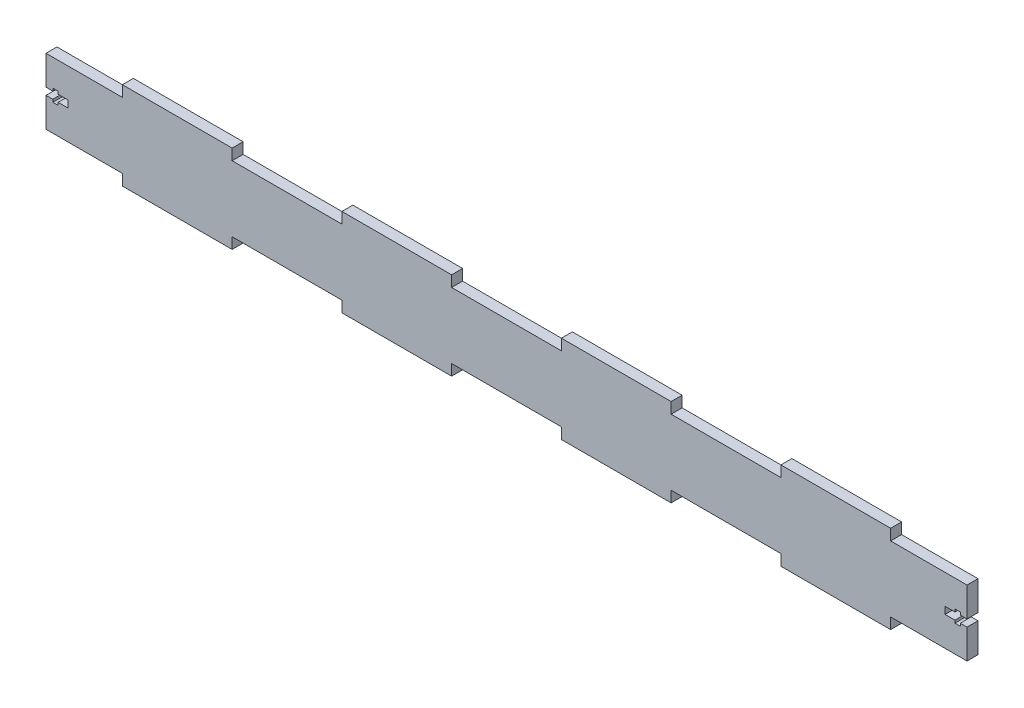
from build123d import *

# Parameters (mm, degrees)
BOSS_EXTRU_1_DEPTH      = 5
ESQUISSE2_W             = 2.27948718
ESQUISSE2_H             = 12.7
ENL_V_MAT_EXTRU_2_DEPTH = 1


with BuildPart() as part:
    # Esquisse1 → Boss.-Extru.1 (new body)
    with BuildSketch(Plane.XY):
        Polygon((-88.842780237, 31.877465299), (-88.842780237, 36.877465299), (-38.842780237, 36.877465299), (-38.842780237, 31.877465299), (11.157219763, 31.877465299), (11.157219763, 36.877465299), (61.157219763, 36.877465299), (61.157219763, 31.877465299), (111.157219763, 31.877465299), (111.157219763, 36.877465299), (161.157219763, 36.877465299), (161.157219763, 31.877465299), (211.157219763, 31.877465299), (211.157219763, 36.877465299), (261.157219763, 36.877465299), (261.157219763, 31.877465299), (295.957219763, 31.877465299), (295.957219763, 18.477465299), (292.875370019, 18.477465299), (292.875370019, 19.677465299), (290.455370019, 19.677465299), (290.455370019, 18.477465299), (285.957219763, 18.477465299), (285.957219763, 15.277465299), (290.455370019, 15.277465299), (290.455370019, 14.077465299), (292.875370019, 14.077465299), (292.875370019, 15.277465299), (295.957219763, 15.277465299), (295.957219763, 1.877465299), (261.157219763, 1.877465299), (261.157219763, -3.122534701), (211.157219763, -3.122534701), (211.157219763, 1.877465299), (161.157219763, 1.877465299), (161.157219763, -3.122534701), (111.157219763, -3.122534701), (111.157219763, 1.877465299), (61.157219763, 1.877465299), (61.157219763, -3.122534701), (11.157219763, -3.122534701), (11.157219763, 1.877465299), (-38.842780237, 1.877465299), (-38.842780237, -3.122534701), (-88.842780237, -3.122534701), (-88.842780237, 1.877465299), (-123.642780237, 1.877465299), (-123.642780237, 15.277465299), (-120.560930493, 15.277465299), (-120.560930493, 14.077465299), (-118.140930493, 14.077465299), (-118.140930493, 15.277465299), (-113.642780237, 15.277465299), (-113.642780237, 18.477465299), (-118.140930493, 18.477465299), (-118.140930493, 19.677465299), (-120.560930493, 19.677465299), (-120.560930493, 18.477465299), (-123.642780237, 18.477465299), (-123.642780237, 31.877465299), align=None)
    extrude(amount=BOSS_EXTRU_1_DEPTH)

    # Esquisse2 → Enlèv. mat.-Extru.2 (cut)
    # profile 1 of 20: a face of its own
    with BuildSketch(Plane(origin=(0, 0, 0), x_dir=(-1, 0, 0), z_dir=(0, 0, -1))):
        Polygon((-193.209162872, 23.371700619), (-191.095040276, 23.371700619), (-185.966194122, 10.671700619), (-188.400869603, 10.671700619), (-189.387968962, 13.276828824), (-194.921322327, 13.276828824), (-195.908421686, 10.671700619), (-198.340553096, 10.671700619), align=None)
        Polygon((-192.153373609, 19.965190202), (-194.056338353, 15.556316003), (-190.250408866, 15.556316003), align=None, mode=Mode.SUBTRACT)
    # profile 2 of 20: a face of its own
    with BuildSketch(Plane(origin=(0, 0, 0), x_dir=(-1, 0, 0), z_dir=(0, 0, -1))):
        Polygon((-184.093758225, 23.371700619), (-177.255296686, 23.371700619), (-177.255296686, 21.092213439), (-181.814271045, 21.092213439), (-181.814271045, 18.649905747), (-177.255296686, 18.649905747), (-177.255296686, 16.370418567), (-181.814271045, 16.370418567), (-181.814271045, 12.951187798), (-177.255296686, 12.951187798), (-177.255296686, 10.671700619), (-184.093758225, 10.671700619), align=None)
    # profile 3 of 20: a face of its own
    with BuildSketch(Plane(origin=(0, 0, 0), x_dir=(-1, 0, 0), z_dir=(0, 0, -1))):
        with BuildLine():
            Line((-174.975809507, 23.371700619), (-172.319799891, 23.371700619))
            add(Edge.make_bspline(
                [(-172.319799891, 23.371700619), (-172.144238464, 23.371077476), (-171.806584387, 23.369878998), (-171.31970565, 23.350970187), (-170.872440573, 23.324657024), (-170.46412694, 23.284502439), (-170.094939434, 23.231262314), (-169.764508044, 23.168501015), (-169.472842426, 23.096971061), (-169.217482785, 23.007839093), (-168.987033337, 22.907299585), (-168.772222412, 22.791777847), (-168.568310963, 22.66256025), (-168.376661917, 22.516246729), (-168.195609799, 22.355469428), (-168.024813043, 22.18006651), (-167.866685166, 21.988550629), (-167.722205303, 21.782131923), (-167.590523537, 21.564984178), (-167.474144474, 21.336809248), (-167.379504827, 21.097448453), (-167.295880553, 20.850361075), (-167.235648698, 20.592014949), (-167.193758324, 20.324925121), (-167.163087831, 20.048151404), (-167.161324424, 19.860123629), (-167.160424891, 19.764208631)],
                knots=[0, 0, 0, 0, 1.749336639, 3.364467119, 4.854658419, 6.213483162, 7.451590619, 8.570285859, 9.5643256, 10.440900261, 11.26203566, 12.067320669, 12.869050712, 13.665104639, 14.467235401, 15.27997916, 16.102287765, 16.939272006, 17.78853747, 18.631303466, 19.488103222, 20.351255419, 21.228522269, 22.127379805, 23.044756219, 24, 24, 24, 24], degree=3))
            add(Edge.make_bspline(
                [(-167.160424891, 19.764208631), (-167.162761554, 19.664095407), (-167.167343324, 19.467791622), (-167.192023229, 19.179437371), (-167.237130342, 18.903560193), (-167.305451627, 18.640967823), (-167.383978069, 18.388391992), (-167.488398095, 18.150492883), (-167.606246415, 17.923810597), (-167.746211421, 17.711551642), (-167.899816178, 17.509001321), (-168.078455278, 17.32392009), (-168.270555653, 17.146360532), (-168.486915964, 16.987444376), (-168.717998848, 16.836426286), (-168.968395678, 16.699563679), (-169.236472279, 16.573416144), (-169.424943406, 16.503067565), (-169.521322327, 16.467093247)],
                knots=[0, 0, 0, 0, 1.099860209, 2.156625411, 3.176576793, 4.16617041, 5.135385252, 6.078461593, 7.016046972, 7.938469504, 8.868247731, 9.803980173, 10.76021508, 11.73834243, 12.748633912, 13.790971185, 14.870363756, 16, 16, 16, 16], degree=3))
            Line((-169.521322327, 16.467093247), (-166.590553096, 10.671700619))
            Line((-166.590553096, 10.671700619), (-169.124447327, 10.671700619))
            Line((-169.124447327, 10.671700619), (-171.922924891, 16.207598055))
            Line((-171.922924891, 16.207598055), (-172.696322327, 16.207598055))
            Line((-172.696322327, 16.207598055), (-172.696322327, 10.671700619))
            Line((-172.696322327, 10.671700619), (-174.975809507, 10.671700619))
            Line((-174.975809507, 10.671700619), (-174.975809507, 23.371700619))
        make_face()
        with BuildLine():
            Line((-172.696322327, 18.487085234), (-171.808441718, 18.487085234))
            add(Edge.make_bspline(
                [(-171.808441718, 18.487085234), (-171.699890933, 18.488307806), (-171.492039505, 18.490648768), (-171.193121851, 18.501507123), (-170.921633333, 18.527670391), (-170.676408089, 18.560726703), (-170.456212165, 18.598894989), (-170.263009634, 18.65359246), (-170.093823537, 18.712202185), (-169.950658738, 18.78503887), (-169.828342023, 18.867869978), (-169.722729369, 18.961968175), (-169.63537256, 19.070874857), (-169.563473451, 19.19163041), (-169.507543762, 19.325302886), (-169.466719373, 19.470424865), (-169.443904576, 19.628649473), (-169.441279656, 19.737845997), (-169.439912071, 19.794737478)],
                knots=[0, 0, 0, 0, 1.688639943, 3.233382647, 4.650958383, 5.928841754, 7.082724185, 8.122798841, 9.049171256, 9.863274652, 10.613301712, 11.341792392, 12.054588806, 12.776240173, 13.521029143, 14.301969904, 15.115324896, 16, 16, 16, 16], degree=3))
            add(Edge.make_bspline(
                [(-169.439912071, 19.794737478), (-169.442497617, 19.862044252), (-169.447576442, 19.994255939), (-169.497974169, 20.184594408), (-169.578196465, 20.360765683), (-169.68815926, 20.52197378), (-169.826643104, 20.663299927), (-169.985564242, 20.78788005), (-170.168352574, 20.88638869), (-170.337600814, 20.95136394), (-170.491577152, 20.990239303), (-170.63053594, 21.019208879), (-170.791451052, 21.039740449), (-170.974443972, 21.061517834), (-171.179048244, 21.075639366), (-171.406379084, 21.085945269), (-171.655783598, 21.090161921), (-171.829642232, 21.09150991), (-171.920380821, 21.092213439)],
                knots=[0, 0, 0, 0, 1.020303359, 2.004196876, 2.966617323, 3.9489082, 4.950758222, 5.960522915, 7.003732012, 8.091992268, 8.70421221, 9.413913587, 10.24622431, 11.166358409, 12.212345909, 13.359657661, 14.621978493, 16, 16, 16, 16], degree=3))
            Line((-171.920380821, 21.092213439), (-172.696322327, 21.092213439))
            Line((-172.696322327, 21.092213439), (-172.696322327, 18.487085234))
        make_face(mode=Mode.SUBTRACT)
    # profile 4 of 20: a face of its own
    with BuildSketch(Plane(origin=(0, 0, 0), x_dir=(-1, 0, 0), z_dir=(0, 0, -1))):
        with BuildLine():
            add(Edge.make_bspline(
                [(-158.749727776, 23.697341644), (-158.528922711, 23.691624606), (-158.093003502, 23.680337877), (-157.451923653, 23.586254182), (-156.834124683, 23.43295829), (-156.239885959, 23.219865911), (-155.670695386, 22.941205423), (-155.12454524, 22.604877032), (-154.603391803, 22.204532741), (-154.112575439, 21.749511922), (-153.658972598, 21.25469665), (-153.265925471, 20.721940039), (-152.9307493, 20.165046347), (-152.652954394, 19.582523362), (-152.441361866, 18.970336834), (-152.292878637, 18.331608105), (-152.197485519, 17.666518888), (-152.186513843, 17.213683784), (-152.180937712, 16.983539561)],
                knots=[0, 0, 0, 0, 1.014329547, 2.002516266, 2.970391464, 3.935626869, 4.897733899, 5.877609409, 6.878433252, 7.912639331, 8.949961323, 9.958554974, 10.949718813, 11.932905612, 12.9188844, 13.919928257, 14.942845884, 16, 16, 16, 16], degree=3))
            add(Edge.make_bspline(
                [(-152.180937712, 16.983539561), (-152.18687605, 16.755988532), (-152.198577736, 16.307591929), (-152.288984273, 15.648631771), (-152.439967977, 15.016745157), (-152.64797173, 14.410501799), (-152.920728487, 13.832838131), (-153.249368357, 13.28006585), (-153.642563521, 12.757314816), (-154.085972608, 12.264865557), (-154.574127532, 11.817862187), (-155.091161089, 11.423941238), (-155.63468594, 11.090147492), (-156.203906535, 10.816633842), (-156.800043543, 10.604369971), (-157.421624431, 10.454602386), (-158.068610737, 10.363585601), (-158.5085928, 10.351960349), (-158.731919282, 10.346059593)],
                knots=[0, 0, 0, 0, 1.051557043, 2.072126891, 3.067553643, 4.050577992, 5.02905126, 6.015227836, 7.017913613, 8.04756643, 9.074058332, 10.072836633, 11.047628519, 12.017157415, 12.98668631, 13.966869689, 14.968021931, 16, 16, 16, 16], degree=3))
            add(Edge.make_bspline(
                [(-158.731919282, 10.346059593), (-158.965492005, 10.351352862), (-159.424430477, 10.361753411), (-160.096088987, 10.460657888), (-160.739595875, 10.60964258), (-161.349545313, 10.831994241), (-161.932149116, 11.109952514), (-162.483126721, 11.452274791), (-163.002292965, 11.85839536), (-163.486669824, 12.31791332), (-163.925516431, 12.820726757), (-164.312884643, 13.351904564), (-164.639638322, 13.907389009), (-164.905789424, 14.487440072), (-165.115612262, 15.088452876), (-165.263618434, 15.714087763), (-165.351049211, 16.362844232), (-165.363227811, 16.803492595), (-165.36939925, 17.02678876)],
                knots=[0, 0, 0, 0, 1.067978421, 2.098431617, 3.099715153, 4.085208694, 5.062210972, 6.048429807, 7.046490867, 8.072918869, 9.098532598, 10.095778865, 11.076610158, 12.041847152, 13.011192615, 13.984257998, 14.978533688, 16, 16, 16, 16], degree=3))
            add(Edge.make_bspline(
                [(-165.36939925, 17.02678876), (-165.367462297, 17.17701073), (-165.363612917, 17.475552515), (-165.31724308, 17.917976202), (-165.250483845, 18.351764372), (-165.151750106, 18.775187506), (-165.031813847, 19.191232657), (-164.876419482, 19.596027175), (-164.699538641, 19.993895377), (-164.492870032, 20.380137941), (-164.263074522, 20.751201115), (-164.012347162, 21.105334527), (-163.7400575, 21.438256187), (-163.447082672, 21.752153919), (-163.132413047, 22.044964451), (-162.800187779, 22.320832924), (-162.443963633, 22.572431289), (-162.071537236, 22.80590408), (-161.685008244, 23.017029477), (-161.28595018, 23.1967331), (-160.882584428, 23.353665214), (-160.469522566, 23.477522977), (-160.051191287, 23.578403829), (-159.623121568, 23.645118067), (-159.189180777, 23.691486621), (-158.896559746, 23.695385338), (-158.749727776, 23.697341644)],
                knots=[0, 0, 0, 0, 1.034744296, 2.056386356, 3.06226378, 4.057406941, 5.050368692, 6.043467995, 7.042652155, 8.049140477, 9.059438543, 10.048523776, 11.036952808, 12.020949711, 13.004946614, 13.997082645, 14.994316842, 16.007702937, 17.024872941, 18.026463647, 19.021641123, 20.005082605, 20.995858141, 21.984425357, 22.988620895, 24, 24, 24, 24], degree=3))
        make_face()
        with BuildLine():
            add(Edge.make_bspline(
                [(-158.785344763, 21.417854465), (-158.933946542, 21.413867145), (-159.22722699, 21.405997773), (-159.657415995, 21.346043795), (-160.070412632, 21.250290477), (-160.463927497, 21.111592967), (-160.839666118, 20.935066238), (-161.198294564, 20.721327097), (-161.534846571, 20.463028498), (-161.853809735, 20.174037343), (-162.141940468, 19.852034782), (-162.39651306, 19.506954275), (-162.609549316, 19.139372102), (-162.787968515, 18.752703014), (-162.922278629, 18.342599019), (-163.017943696, 17.912272506), (-163.078400447, 17.460982001), (-163.086021096, 17.153337851), (-163.089912071, 16.996259914)],
                knots=[0, 0, 0, 0, 1.033739768, 2.040188636, 3.016340934, 3.979330865, 4.937572243, 5.900995986, 6.878200029, 7.884839167, 8.891893314, 9.879764717, 10.863503415, 11.843163062, 12.837761627, 13.859916423, 14.907309254, 16, 16, 16, 16], degree=3))
            add(Edge.make_bspline(
                [(-163.089912071, 16.996259914), (-163.084753232, 16.822182224), (-163.074642762, 16.481018796), (-163.003504266, 15.983338779), (-162.88179338, 15.513329398), (-162.706045228, 15.073289398), (-162.488071411, 14.658332465), (-162.217382525, 14.273544485), (-161.898362448, 13.916621529), (-161.652591966, 13.70823504), (-161.527852776, 13.602469849)],
                knots=[0, 0, 0, 0, 1.078454662, 2.113592447, 3.107694534, 4.079536787, 5.043276885, 6.005368276, 6.987637804, 8, 8, 8, 8], degree=3))
            add(Edge.make_bspline(
                [(-161.527852776, 13.602469849), (-161.425667565, 13.524334589), (-161.223599394, 13.369824469), (-160.901054599, 13.171788054), (-160.568896973, 13.00205109), (-160.224619968, 12.864905632), (-159.868950682, 12.757029319), (-159.501937886, 12.681485311), (-159.124101608, 12.634074913), (-158.868591009, 12.628408473), (-158.739551494, 12.625546773)],
                knots=[0, 0, 0, 0, 1.023928204, 2.024787132, 3.009472467, 3.9914905, 4.972207045, 5.96565515, 6.972602802, 8, 8, 8, 8], degree=3))
            add(Edge.make_bspline(
                [(-158.739551494, 12.625546773), (-158.593504926, 12.6295679), (-158.30615371, 12.637479595), (-157.883972906, 12.696695506), (-157.479510872, 12.796910208), (-157.090256675, 12.934391015), (-156.71733275, 13.113134189), (-156.362561678, 13.333502849), (-156.025321448, 13.592791149), (-155.706764639, 13.885577391), (-155.415588656, 14.20884842), (-155.161547305, 14.55576955), (-154.94173756, 14.918697072), (-154.767028591, 15.302767672), (-154.627412188, 15.704355906), (-154.5328985, 16.125240321), (-154.471931027, 16.56368587), (-154.464308231, 16.862063561), (-154.460424891, 17.014068407)],
                knots=[0, 0, 0, 0, 1.026359118, 2.019393844, 2.989460624, 3.950973911, 4.916101784, 5.890408035, 6.881132271, 7.902007068, 8.92769091, 9.933912415, 10.920395702, 11.90457117, 12.894218921, 13.903490204, 14.931958862, 16, 16, 16, 16], degree=3))
            add(Edge.make_bspline(
                [(-154.460424891, 17.014068407), (-154.464442595, 17.165199183), (-154.472350832, 17.462677067), (-154.531670967, 17.899995377), (-154.631250134, 18.31902171), (-154.76914378, 18.720440381), (-154.945226665, 19.104644929), (-155.162971016, 19.470284265), (-155.421612794, 19.817004904), (-155.715199375, 20.142444078), (-156.034750324, 20.441501832), (-156.377820197, 20.7010296), (-156.734809514, 20.926550979), (-157.113909352, 21.10321532), (-157.507363645, 21.243963426), (-157.917573271, 21.347612351), (-158.346091927, 21.405576593), (-158.637622028, 21.41372536), (-158.785344763, 21.417854465)],
                knots=[0, 0, 0, 0, 1.055025985, 2.07665775, 3.074803781, 4.057872707, 5.035505728, 6.020516407, 7.023567878, 8.050795229, 9.077271434, 10.074415901, 11.050397877, 12.019801805, 12.988065821, 13.964604439, 14.968634123, 16, 16, 16, 16], degree=3))
        make_face(mode=Mode.SUBTRACT)
    # profile 5 of 20: a face of its own
    with BuildSketch(Plane(origin=(0, 0, 0), x_dir=(-1, 0, 0), z_dir=(0, 0, -1))):
        with BuildLine():
            Line((-149.901450532, 10.671700619), (-149.901450532, 23.371700619))
            Line((-149.901450532, 23.371700619), (-147.866194122, 23.371700619))
            add(Edge.make_bspline(
                [(-147.866194122, 23.371700619), (-147.723713447, 23.371716879), (-147.448016043, 23.371748343), (-147.05025664, 23.357780339), (-146.681368384, 23.33971116), (-146.342525223, 23.319495951), (-146.033150421, 23.284661108), (-145.753714434, 23.247948987), (-145.503658946, 23.203676433), (-145.349063226, 23.16396258), (-145.27633034, 23.145278343)],
                knots=[0, 0, 0, 0, 1.311965854, 2.538629056, 3.664479157, 4.713267157, 5.663616078, 6.530575999, 7.308677837, 8, 8, 8, 8], degree=3))
            add(Edge.make_bspline(
                [(-145.27633034, 23.145278343), (-145.180824677, 23.118923894), (-144.993411905, 23.067208003), (-144.724977009, 22.962765528), (-144.470329065, 22.846670311), (-144.229778991, 22.714227382), (-144.004803862, 22.563837784), (-143.796258659, 22.394307979), (-143.599645578, 22.212442887), (-143.421945901, 22.013173978), (-143.261334672, 21.802609464), (-143.121792309, 21.580804517), (-143.000547881, 21.351150681), (-142.903520581, 21.110757914), (-142.830412333, 20.86073329), (-142.776941266, 20.602144454), (-142.742284773, 20.334173165), (-142.739010189, 20.151863539), (-142.737347968, 20.059320811)],
                knots=[0, 0, 0, 0, 1.099996261, 2.158545794, 3.195537121, 4.207578794, 5.205712374, 6.197378256, 7.190519799, 8.17788031, 9.159561366, 10.129234751, 11.085776129, 12.040971148, 13.00380137, 13.975669004, 14.972423361, 16, 16, 16, 16], degree=3))
            add(Edge.make_bspline(
                [(-142.737347968, 20.059320811), (-142.741694183, 19.940427696), (-142.750249173, 19.706401209), (-142.80489903, 19.362658638), (-142.907376026, 19.037772502), (-143.041464683, 18.725755271), (-143.223783336, 18.427770771), (-143.455292764, 18.143960687), (-143.732243272, 17.86558608), (-143.944679601, 17.69871928), (-144.055176494, 17.611924978)],
                knots=[0, 0, 0, 0, 0.986156485, 1.941127874, 2.875419072, 3.804401753, 4.751181392, 5.761612777, 6.835722519, 8, 8, 8, 8], degree=3))
            add(Edge.make_bspline(
                [(-144.055176494, 17.611924978), (-143.965635113, 17.566214879), (-143.790069237, 17.476590022), (-143.540817272, 17.329273512), (-143.310037161, 17.17258372), (-143.096694155, 17.009673307), (-142.905263368, 16.833636266), (-142.727840301, 16.654616092), (-142.573178088, 16.462355673), (-142.434874476, 16.263707538), (-142.314663224, 16.055795238), (-142.209972479, 15.83896989), (-142.121543963, 15.612490771), (-142.046660408, 15.377510478), (-141.990812232, 15.133220787), (-141.954398034, 14.879534331), (-141.926517048, 14.617316309), (-141.92434817, 14.43869994), (-141.923245404, 14.34788251)],
                knots=[0, 0, 0, 0, 1.164658916, 2.283573913, 3.35186032, 4.395461096, 5.390182219, 6.362969632, 7.312859996, 8.245001507, 9.165155236, 10.092416118, 11.032087915, 11.979892451, 12.947605196, 13.931445124, 14.948243989, 16, 16, 16, 16], degree=3))
            add(Edge.make_bspline(
                [(-141.923245404, 14.34788251), (-141.930401616, 14.17442641), (-141.944524371, 13.832111492), (-142.047783067, 13.329514575), (-142.226800834, 12.853007112), (-142.467184782, 12.404482948), (-142.763384055, 11.99692612), (-143.103928279, 11.639909878), (-143.485388955, 11.337703555), (-143.837332533, 11.133737731), (-144.141736013, 10.99685759), (-144.393867728, 10.912229655), (-144.664651845, 10.833830464), (-144.95904848, 10.778776933), (-145.271720623, 10.728385888), (-145.605716846, 10.697273413), (-145.960412917, 10.676189255), (-146.204033512, 10.67322708), (-146.329575532, 10.671700619)],
                knots=[0, 0, 0, 0, 1.284142165, 2.534249414, 3.780121997, 5.041676246, 6.291546858, 7.49970053, 8.684500223, 9.883330709, 10.50184324, 11.153274765, 11.851151195, 12.587658647, 13.369265475, 14.195992086, 15.070362669, 16, 16, 16, 16], degree=3))
            Line((-146.329575532, 10.671700619), (-149.901450532, 10.671700619))
        make_face()
        with BuildLine():
            Line((-147.621963353, 21.092213439), (-147.621963353, 18.324264721))
            Line((-147.621963353, 18.324264721), (-147.016474571, 18.324264721))
            add(Edge.make_bspline(
                [(-147.016474571, 18.324264721), (-146.934183205, 18.324982333), (-146.775324704, 18.326367639), (-146.54587045, 18.344209903), (-146.332515049, 18.374649912), (-146.136067713, 18.417121383), (-145.954698462, 18.471053958), (-145.789565937, 18.535946461), (-145.641396194, 18.615122368), (-145.469257223, 18.733058375), (-145.287293917, 18.90660649), (-145.127113665, 19.1573327), (-145.032768567, 19.445666888), (-145.022261067, 19.649022483), (-145.016835148, 19.754032349)],
                knots=[0, 0, 0, 0, 1.065314748, 2.056525647, 2.977365736, 3.853934255, 4.656397591, 5.425096493, 6.14721249, 6.826394842, 8.123232004, 9.372140726, 10.643011755, 12, 12, 12, 12], degree=3))
            add(Edge.make_bspline(
                [(-145.016835148, 19.754032349), (-145.021176877, 19.852391537), (-145.029571435, 20.042565073), (-145.12456482, 20.309585654), (-145.272108325, 20.546220538), (-145.446304171, 20.708177764), (-145.61034341, 20.818789775), (-145.750803872, 20.891623074), (-145.904969776, 20.956822698), (-146.07582561, 21.006675921), (-146.262395692, 21.044084023), (-146.463773747, 21.071555794), (-146.680307223, 21.090254251), (-146.829867356, 21.091546368), (-146.907079539, 21.092213439)],
                knots=[0, 0, 0, 0, 1.347982417, 2.606269829, 3.849316587, 5.153353503, 5.842674298, 6.568177932, 7.326619318, 8.142485038, 9.012069166, 9.942760135, 10.937925643, 12, 12, 12, 12], degree=3))
            Line((-146.907079539, 21.092213439), (-147.621963353, 21.092213439))
        make_face(mode=Mode.SUBTRACT)
        with BuildLine():
            Line((-147.621963353, 16.207598055), (-147.621963353, 12.951187798))
            Line((-147.621963353, 12.951187798), (-146.965593161, 12.951187798))
            add(Edge.make_bspline(
                [(-146.965593161, 12.951187798), (-146.835827938, 12.951929142), (-146.586338104, 12.953354468), (-146.22894436, 12.970575798), (-145.903984098, 13.001614209), (-145.612318341, 13.040363166), (-145.353500346, 13.092861942), (-145.128404981, 13.159607407), (-144.933945355, 13.233039045), (-144.771287457, 13.323735835), (-144.638405272, 13.429284409), (-144.518493033, 13.537157586), (-144.420724065, 13.661599487), (-144.343367433, 13.797268167), (-144.276415405, 13.940793517), (-144.236034669, 14.097780151), (-144.205290194, 14.263575361), (-144.203598244, 14.378252322), (-144.202732584, 14.436924978)],
                knots=[0, 0, 0, 0, 1.753078804, 3.370512758, 4.83203934, 6.162291463, 7.344201807, 8.395507345, 9.331626367, 10.147333109, 10.898971645, 11.62040215, 12.321813352, 13.025280112, 13.727906689, 14.453419512, 15.208716525, 16, 16, 16, 16], degree=3))
            add(Edge.make_bspline(
                [(-144.202732584, 14.436924978), (-144.204641612, 14.504018082), (-144.208359886, 14.634697401), (-144.238727074, 14.825699172), (-144.293914174, 15.004011998), (-144.363425019, 15.174195578), (-144.460153053, 15.330156749), (-144.575111016, 15.477292734), (-144.714009583, 15.610621054), (-144.870209124, 15.738205906), (-145.052400424, 15.849913356), (-145.260668962, 15.946839356), (-145.496146165, 16.027788381), (-145.75956145, 16.092240048), (-146.049760025, 16.146939287), (-146.368860019, 16.179600771), (-146.714203858, 16.203892552), (-146.953670896, 16.206334821), (-147.077532263, 16.207598055)],
                knots=[0, 0, 0, 0, 0.845221588, 1.646264278, 2.427170338, 3.19324141, 3.95557735, 4.731569926, 5.540061037, 6.376114724, 7.268642756, 8.224665384, 9.265483498, 10.400594375, 11.639216012, 12.983232105, 14.439614077, 16, 16, 16, 16], degree=3))
            Line((-147.077532263, 16.207598055), (-147.621963353, 16.207598055))
        make_face(mode=Mode.SUBTRACT)
    # profile 6 of 20: a face of its own
    with BuildSketch(Plane(origin=(0, 0, 0), x_dir=(-1, 0, 0), z_dir=(0, 0, -1))):
        with BuildLine():
            add(Edge.make_bspline(
                [(-133.675368802, 23.697341644), (-133.454563737, 23.691624606), (-133.018644528, 23.680337877), (-132.377564678, 23.586254182), (-131.759765708, 23.43295829), (-131.165526984, 23.219865911), (-130.596336412, 22.941205423), (-130.050186265, 22.604877032), (-129.529032829, 22.204532741), (-129.038216464, 21.749511922), (-128.584613623, 21.25469665), (-128.191566496, 20.721940039), (-127.856390326, 20.165046347), (-127.578595419, 19.582523362), (-127.367002892, 18.970336834), (-127.218519663, 18.331608105), (-127.123126545, 17.666518888), (-127.112154869, 17.213683784), (-127.106578737, 16.983539561)],
                knots=[0, 0, 0, 0, 1.014329547, 2.002516266, 2.970391464, 3.935626869, 4.897733899, 5.877609409, 6.878433252, 7.912639331, 8.949961323, 9.958554974, 10.949718813, 11.932905612, 12.9188844, 13.919928257, 14.942845884, 16, 16, 16, 16], degree=3))
            add(Edge.make_bspline(
                [(-127.106578737, 16.983539561), (-127.112517076, 16.755988532), (-127.124218762, 16.307591929), (-127.214625298, 15.648631771), (-127.365609003, 15.016745157), (-127.573612756, 14.410501799), (-127.846369513, 13.832838131), (-128.175009383, 13.28006585), (-128.568204547, 12.757314816), (-129.011613634, 12.264865557), (-129.499768557, 11.817862187), (-130.016802115, 11.423941238), (-130.560326965, 11.090147492), (-131.129547561, 10.816633842), (-131.725684569, 10.604369971), (-132.347265457, 10.454602386), (-132.994251763, 10.363585601), (-133.434233826, 10.351960349), (-133.657560308, 10.346059593)],
                knots=[0, 0, 0, 0, 1.051557043, 2.072126891, 3.067553643, 4.050577992, 5.02905126, 6.015227836, 7.017913613, 8.04756643, 9.074058332, 10.072836633, 11.047628519, 12.017157415, 12.98668631, 13.966869689, 14.968021931, 16, 16, 16, 16], degree=3))
            add(Edge.make_bspline(
                [(-133.657560308, 10.346059593), (-133.89113303, 10.351352862), (-134.350071503, 10.361753411), (-135.021730012, 10.460657888), (-135.6652369, 10.60964258), (-136.275186339, 10.831994241), (-136.857790141, 11.109952514), (-137.408767747, 11.452274791), (-137.92793399, 11.85839536), (-138.41231085, 12.31791332), (-138.851157457, 12.820726757), (-139.238525668, 13.351904564), (-139.565279347, 13.907389009), (-139.83143045, 14.487440072), (-140.041253288, 15.088452876), (-140.189259459, 15.714087763), (-140.276690237, 16.362844232), (-140.288868837, 16.803492595), (-140.295040276, 17.02678876)],
                knots=[0, 0, 0, 0, 1.067978421, 2.098431617, 3.099715153, 4.085208694, 5.062210972, 6.048429807, 7.046490867, 8.072918869, 9.098532598, 10.095778865, 11.076610158, 12.041847152, 13.011192615, 13.984257998, 14.978533688, 16, 16, 16, 16], degree=3))
            add(Edge.make_bspline(
                [(-140.295040276, 17.02678876), (-140.293103323, 17.17701073), (-140.289253943, 17.475552515), (-140.242884105, 17.917976202), (-140.176124871, 18.351764372), (-140.077391131, 18.775187506), (-139.957454873, 19.191232657), (-139.802060507, 19.596027175), (-139.625179666, 19.993895377), (-139.418511058, 20.380137941), (-139.188715548, 20.751201115), (-138.937988187, 21.105334527), (-138.665698526, 21.438256187), (-138.372723698, 21.752153919), (-138.058054073, 22.044964451), (-137.725828805, 22.320832924), (-137.369604658, 22.572431289), (-136.997178262, 22.80590408), (-136.610649269, 23.017029477), (-136.211591205, 23.1967331), (-135.808225453, 23.353665214), (-135.395163592, 23.477522977), (-134.976832313, 23.578403829), (-134.548762594, 23.645118067), (-134.114821802, 23.691486621), (-133.822200772, 23.695385338), (-133.675368802, 23.697341644)],
                knots=[0, 0, 0, 0, 1.034744296, 2.056386356, 3.06226378, 4.057406941, 5.050368692, 6.043467995, 7.042652155, 8.049140477, 9.059438543, 10.048523776, 11.036952808, 12.020949711, 13.004946614, 13.997082645, 14.994316842, 16.007702937, 17.024872941, 18.026463647, 19.021641123, 20.005082605, 20.995858141, 21.984425357, 22.988620895, 24, 24, 24, 24], degree=3))
        make_face()
        with BuildLine():
            add(Edge.make_bspline(
                [(-133.710985789, 21.417854465), (-133.859587568, 21.413867145), (-134.152868015, 21.405997773), (-134.58305702, 21.346043795), (-134.996053657, 21.250290477), (-135.389568523, 21.111592967), (-135.765307144, 20.935066238), (-136.12393559, 20.721327097), (-136.460487597, 20.463028498), (-136.779450761, 20.174037343), (-137.067581494, 19.852034782), (-137.322154086, 19.506954275), (-137.535190342, 19.139372102), (-137.713609541, 18.752703014), (-137.847919654, 18.342599019), (-137.943584721, 17.912272506), (-138.004041473, 17.460982001), (-138.011662121, 17.153337851), (-138.015553096, 16.996259914)],
                knots=[0, 0, 0, 0, 1.033739768, 2.040188636, 3.016340934, 3.979330865, 4.937572243, 5.900995986, 6.878200029, 7.884839167, 8.891893314, 9.879764717, 10.863503415, 11.843163062, 12.837761627, 13.859916423, 14.907309254, 16, 16, 16, 16], degree=3))
            add(Edge.make_bspline(
                [(-138.015553096, 16.996259914), (-138.010394257, 16.822182224), (-138.000283787, 16.481018796), (-137.929145291, 15.983338779), (-137.807434406, 15.513329398), (-137.631686253, 15.073289398), (-137.413712436, 14.658332465), (-137.14302355, 14.273544485), (-136.824003474, 13.916621529), (-136.578232991, 13.70823504), (-136.453493802, 13.602469849)],
                knots=[0, 0, 0, 0, 1.078454662, 2.113592447, 3.107694534, 4.079536787, 5.043276885, 6.005368276, 6.987637804, 8, 8, 8, 8], degree=3))
            add(Edge.make_bspline(
                [(-136.453493802, 13.602469849), (-136.351308591, 13.524334589), (-136.14924042, 13.369824469), (-135.826695625, 13.171788054), (-135.494537998, 13.00205109), (-135.150260994, 12.864905632), (-134.794591708, 12.757029319), (-134.427578912, 12.681485311), (-134.049742634, 12.634074913), (-133.794232035, 12.628408473), (-133.66519252, 12.625546773)],
                knots=[0, 0, 0, 0, 1.023928204, 2.024787132, 3.009472467, 3.9914905, 4.972207045, 5.96565515, 6.972602802, 8, 8, 8, 8], degree=3))
            add(Edge.make_bspline(
                [(-133.66519252, 12.625546773), (-133.519145951, 12.6295679), (-133.231794736, 12.637479595), (-132.809613931, 12.696695506), (-132.405151898, 12.796910208), (-132.015897701, 12.934391015), (-131.642973776, 13.113134189), (-131.288202704, 13.333502849), (-130.950962474, 13.592791149), (-130.632405664, 13.885577391), (-130.341229682, 14.20884842), (-130.08718833, 14.55576955), (-129.867378586, 14.918697072), (-129.692669617, 15.302767672), (-129.553053214, 15.704355906), (-129.458539526, 16.125240321), (-129.397572052, 16.56368587), (-129.389949257, 16.862063561), (-129.386065917, 17.014068407)],
                knots=[0, 0, 0, 0, 1.026359118, 2.019393844, 2.989460624, 3.950973911, 4.916101784, 5.890408035, 6.881132271, 7.902007068, 8.92769091, 9.933912415, 10.920395702, 11.90457117, 12.894218921, 13.903490204, 14.931958862, 16, 16, 16, 16], degree=3))
            add(Edge.make_bspline(
                [(-129.386065917, 17.014068407), (-129.390083621, 17.165199183), (-129.397991858, 17.462677067), (-129.457311993, 17.899995377), (-129.556891159, 18.31902171), (-129.694784806, 18.720440381), (-129.870867691, 19.104644929), (-130.088612042, 19.470284265), (-130.347253819, 19.817004904), (-130.6408404, 20.142444078), (-130.96039135, 20.441501832), (-131.303461223, 20.7010296), (-131.66045054, 20.926550979), (-132.039550377, 21.10321532), (-132.43300467, 21.243963426), (-132.843214297, 21.347612351), (-133.271732952, 21.405576593), (-133.563263054, 21.41372536), (-133.710985789, 21.417854465)],
                knots=[0, 0, 0, 0, 1.055025985, 2.07665775, 3.074803781, 4.057872707, 5.035505728, 6.020516407, 7.023567878, 8.050795229, 9.077271434, 10.074415901, 11.050397877, 12.019801805, 12.988065821, 13.964604439, 14.968634123, 16, 16, 16, 16], degree=3))
        make_face(mode=Mode.SUBTRACT)
    # profile 7 of 20: a face of its own
    with BuildSketch(Plane(origin=(0, 0, 0), x_dir=(-1, 0, 0), z_dir=(0, 0, -1))):
        Polygon((-126.129655661, 23.371700619), (-119.291194122, 23.371700619), (-119.291194122, 21.092213439), (-121.570681302, 21.092213439), (-121.570681302, 10.671700619), (-123.850168481, 10.671700619), (-123.850168481, 21.092213439), (-126.129655661, 21.092213439), align=None)
    # profile 8 of 20: a face of its own
    with BuildSketch(Plane(origin=(0, 0, 0), x_dir=(-1, 0, 0), z_dir=(0, 0, -1))):
        with Locations((-116.686065917, 17.021700619)):
            Rectangle(ESQUISSE2_W, ESQUISSE2_H)
    # profile 9 of 20: a face of its own
    with BuildSketch(Plane(origin=(0, 0, 0), x_dir=(-1, 0, 0), z_dir=(0, 0, -1))):
        Polygon((-113.391494603, 23.371700619), (-110.704956141, 23.371700619), (-108.051490596, 19.293555587), (-105.392936911, 23.371700619), (-102.703854379, 23.371700619), (-106.708221366, 17.230314401), (-102.439271045, 10.671700619), (-105.125809507, 10.671700619), (-108.051490596, 15.169617285), (-110.984803898, 10.671700619), (-113.67388643, 10.671700619), (-109.394759827, 17.232858471), align=None)
    # profile 10 of 20: a face of its own
    with BuildSketch(Plane(origin=(0, 0, 0), x_dir=(-1, 0, 0), z_dir=(0, 0, -1))):
        Polygon((-95.845040276, 23.371700619), (-89.006578737, 23.371700619), (-89.006578737, 21.092213439), (-93.565553096, 21.092213439), (-93.565553096, 18.649905747), (-89.006578737, 18.649905747), (-89.006578737, 16.370418567), (-93.565553096, 16.370418567), (-93.565553096, 12.951187798), (-89.006578737, 12.951187798), (-89.006578737, 10.671700619), (-95.845040276, 10.671700619), align=None)
    # profile 11 of 20: a face of its own
    with BuildSketch(Plane(origin=(0, 0, 0), x_dir=(-1, 0, 0), z_dir=(0, 0, -1))):
        with BuildLine():
            Line((-86.727091558, 23.371700619), (-84.447604379, 23.371700619))
            Line((-84.447604379, 23.371700619), (-84.447604379, 15.108559593))
            add(Edge.make_bspline(
                [(-84.447604379, 15.108559593), (-84.447480431, 15.022890931), (-84.447241028, 14.857422795), (-84.435256396, 14.620030195), (-84.424289631, 14.401816691), (-84.404502473, 14.20302118), (-84.37527006, 14.023558624), (-84.346963545, 13.86227622), (-84.308653476, 13.722061546), (-84.251079568, 13.562460539), (-84.162377075, 13.383140089), (-84.017442123, 13.196248203), (-83.850199588, 13.025682231), (-83.649749776, 12.883709578), (-83.424461915, 12.768866499), (-83.175573861, 12.683780486), (-82.903436458, 12.63648396), (-82.715268371, 12.629263279), (-82.61841768, 12.625546773)],
                knots=[0, 0, 0, 0, 1.155499968, 2.231836252, 3.205919964, 4.102923608, 4.924856345, 5.658536265, 6.31071849, 6.882491295, 7.94666036, 8.992281882, 10.060072772, 11.158554251, 12.289267114, 13.461410017, 14.693379945, 16, 16, 16, 16], degree=3))
            add(Edge.make_bspline(
                [(-82.61841768, 12.625546773), (-82.515525772, 12.628549233), (-82.314903972, 12.634403522), (-82.026341451, 12.691869708), (-81.758986638, 12.783375558), (-81.518500348, 12.913977726), (-81.305121902, 13.070527313), (-81.124501519, 13.2490429), (-80.981956576, 13.449880536), (-80.889051085, 13.63516855), (-80.836889228, 13.805710031), (-80.797791317, 13.958082373), (-80.769128223, 14.137866654), (-80.743124122, 14.342255155), (-80.727497661, 14.573364946), (-80.710553311, 14.829337414), (-80.704343049, 15.11192399), (-80.703284556, 15.308694326), (-80.702732584, 15.411303984)],
                knots=[0, 0, 0, 0, 1.261321664, 2.459363699, 3.594844139, 4.716940403, 5.803436589, 6.833651888, 7.818396249, 8.814403945, 9.360733334, 10.004355033, 10.743453831, 11.592799886, 12.532235708, 13.585170094, 14.740740724, 16, 16, 16, 16], degree=3))
            Line((-80.702732584, 15.411303984), (-80.702732584, 23.371700619))
            Line((-80.702732584, 23.371700619), (-78.423245404, 23.371700619))
            Line((-78.423245404, 23.371700619), (-78.423245404, 15.795458631))
            add(Edge.make_bspline(
                [(-78.423245404, 15.795458631), (-78.423561952, 15.641964331), (-78.424170644, 15.346809761), (-78.433518308, 14.922651873), (-78.453417795, 14.53525168), (-78.470131068, 14.184495985), (-78.502476975, 13.870857314), (-78.536173823, 13.59299634), (-78.579123354, 13.35189774), (-78.643029674, 13.077436283), (-78.753313063, 12.761403967), (-78.931104344, 12.397506456), (-79.156798869, 12.04122875), (-79.423558517, 11.696490149), (-79.724754562, 11.376239099), (-80.053708841, 11.09510013), (-80.40519509, 10.857286879), (-80.782886087, 10.668614165), (-81.186460398, 10.521463672), (-81.61991109, 10.422585952), (-82.082942584, 10.355782923), (-82.402767188, 10.34936567), (-82.56753627, 10.346059593)],
                knots=[0, 0, 0, 0, 1.170808336, 2.251350247, 3.235597562, 4.129743112, 4.929140599, 5.639994148, 6.264258765, 6.79612947, 7.788252245, 8.809469599, 9.879094798, 10.999557536, 12.129761673, 13.226370002, 14.293821979, 15.358369427, 16.438775801, 17.562147481, 18.744053101, 20, 20, 20, 20], degree=3))
            add(Edge.make_bspline(
                [(-82.56753627, 10.346059593), (-82.677012125, 10.347903569), (-82.893005743, 10.351541696), (-83.210662249, 10.383620475), (-83.517739662, 10.430892533), (-83.813660985, 10.499857598), (-84.099453307, 10.58894758), (-84.375040699, 10.698611144), (-84.639399011, 10.8282366), (-84.891048932, 10.976631675), (-85.129680784, 11.137095402), (-85.34777798, 11.314976199), (-85.552845754, 11.497119108), (-85.738959785, 11.691189476), (-85.907517955, 11.895149896), (-86.058173118, 12.109462609), (-86.190701451, 12.334108578), (-86.308436631, 12.573137034), (-86.409206454, 12.83869693), (-86.4941592, 13.140234342), (-86.568375919, 13.482475567), (-86.623529405, 13.866191656), (-86.673531879, 14.290117924), (-86.705180688, 14.755358764), (-86.721737605, 15.261927523), (-86.725261812, 15.613121142), (-86.727091558, 15.795458631)],
                knots=[0, 0, 0, 0, 1.001158378, 1.975264943, 2.917723546, 3.841610987, 4.75185031, 5.653588123, 6.552117133, 7.442167995, 8.324307438, 9.179605724, 10.014504199, 10.831958861, 11.636465792, 12.43274043, 13.225645099, 14.020104002, 14.867201867, 15.819789774, 16.883317127, 18.068162734, 19.364263498, 20.787406516, 22.332041935, 24, 24, 24, 24], degree=3))
            Line((-86.727091558, 15.795458631), (-86.727091558, 23.371700619))
        make_face()
    # profile 12 of 20: a face of its own
    with BuildSketch(Plane(origin=(0, 0, 0), x_dir=(-1, 0, 0), z_dir=(0, 0, -1))):
        with BuildLine():
            Line((-75.492476173, 23.371700619), (-72.836466558, 23.371700619))
            add(Edge.make_bspline(
                [(-72.836466558, 23.371700619), (-72.660905131, 23.371077476), (-72.323251054, 23.369878998), (-71.836372316, 23.350970187), (-71.38910724, 23.324657024), (-70.980793607, 23.284502439), (-70.611606101, 23.231262314), (-70.28117471, 23.168501015), (-69.989509093, 23.096971061), (-69.734149452, 23.007839093), (-69.503700003, 22.907299585), (-69.288889079, 22.791777847), (-69.08497763, 22.66256025), (-68.893328584, 22.516246729), (-68.712276466, 22.355469428), (-68.54147971, 22.18006651), (-68.383351833, 21.988550629), (-68.238871969, 21.782131923), (-68.107190203, 21.564984178), (-67.990811141, 21.336809248), (-67.896171493, 21.097448453), (-67.81254722, 20.850361075), (-67.752315365, 20.592014949), (-67.710424991, 20.324925121), (-67.679754498, 20.048151404), (-67.677991091, 19.860123629), (-67.677091558, 19.764208631)],
                knots=[0, 0, 0, 0, 1.749336639, 3.364467119, 4.854658419, 6.213483162, 7.451590619, 8.570285859, 9.5643256, 10.440900261, 11.26203566, 12.067320669, 12.869050712, 13.665104639, 14.467235401, 15.27997916, 16.102287765, 16.939272006, 17.78853747, 18.631303466, 19.488103222, 20.351255419, 21.228522269, 22.127379805, 23.044756219, 24, 24, 24, 24], degree=3))
            add(Edge.make_bspline(
                [(-67.677091558, 19.764208631), (-67.679428221, 19.664095407), (-67.684009991, 19.467791622), (-67.708689895, 19.179437371), (-67.753797008, 18.903560193), (-67.822118293, 18.640967823), (-67.900644736, 18.388391992), (-68.005064762, 18.150492883), (-68.122913082, 17.923810597), (-68.262878088, 17.711551642), (-68.416482844, 17.509001321), (-68.595121945, 17.32392009), (-68.78722232, 17.146360532), (-69.003582631, 16.987444376), (-69.234665515, 16.836426286), (-69.485062345, 16.699563679), (-69.753138946, 16.573416144), (-69.941610072, 16.503067565), (-70.037988994, 16.467093247)],
                knots=[0, 0, 0, 0, 1.099860209, 2.156625411, 3.176576793, 4.16617041, 5.135385252, 6.078461593, 7.016046972, 7.938469504, 8.868247731, 9.803980173, 10.76021508, 11.73834243, 12.748633912, 13.790971185, 14.870363756, 16, 16, 16, 16], degree=3))
            Line((-70.037988994, 16.467093247), (-67.107219763, 10.671700619))
            Line((-67.107219763, 10.671700619), (-69.641113994, 10.671700619))
            Line((-69.641113994, 10.671700619), (-72.439591558, 16.207598055))
            Line((-72.439591558, 16.207598055), (-73.212988994, 16.207598055))
            Line((-73.212988994, 16.207598055), (-73.212988994, 10.671700619))
            Line((-73.212988994, 10.671700619), (-75.492476173, 10.671700619))
            Line((-75.492476173, 10.671700619), (-75.492476173, 23.371700619))
        make_face()
        with BuildLine():
            Line((-73.212988994, 18.487085234), (-72.325108385, 18.487085234))
            add(Edge.make_bspline(
                [(-72.325108385, 18.487085234), (-72.2165576, 18.488307806), (-72.008706171, 18.490648768), (-71.709788518, 18.501507123), (-71.4383, 18.527670391), (-71.193074755, 18.560726703), (-70.972878832, 18.598894989), (-70.7796763, 18.65359246), (-70.610490204, 18.712202185), (-70.467325405, 18.78503887), (-70.34500869, 18.867869978), (-70.239396035, 18.961968175), (-70.152039227, 19.070874857), (-70.080140118, 19.19163041), (-70.024210428, 19.325302886), (-69.983386039, 19.470424865), (-69.960571243, 19.628649473), (-69.957946323, 19.737845997), (-69.956578737, 19.794737478)],
                knots=[0, 0, 0, 0, 1.688639943, 3.233382647, 4.650958383, 5.928841754, 7.082724185, 8.122798841, 9.049171256, 9.863274652, 10.613301712, 11.341792392, 12.054588806, 12.776240173, 13.521029143, 14.301969904, 15.115324896, 16, 16, 16, 16], degree=3))
            add(Edge.make_bspline(
                [(-69.956578737, 19.794737478), (-69.959164283, 19.862044252), (-69.964243109, 19.994255939), (-70.014640836, 20.184594408), (-70.094863132, 20.360765683), (-70.204825927, 20.52197378), (-70.343309771, 20.663299927), (-70.502230908, 20.78788005), (-70.68501924, 20.88638869), (-70.854267481, 20.95136394), (-71.008243819, 20.990239303), (-71.147202607, 21.019208879), (-71.308117719, 21.039740449), (-71.491110639, 21.061517834), (-71.695714911, 21.075639366), (-71.92304575, 21.085945269), (-72.172450265, 21.090161921), (-72.346308899, 21.09150991), (-72.437047487, 21.092213439)],
                knots=[0, 0, 0, 0, 1.020303359, 2.004196876, 2.966617323, 3.9489082, 4.950758222, 5.960522915, 7.003732012, 8.091992268, 8.70421221, 9.413913587, 10.24622431, 11.166358409, 12.212345909, 13.359657661, 14.621978493, 16, 16, 16, 16], degree=3))
            Line((-72.437047487, 21.092213439), (-73.212988994, 21.092213439))
            Line((-73.212988994, 21.092213439), (-73.212988994, 18.487085234))
        make_face(mode=Mode.SUBTRACT)
    # profile 13 of 20: a face of its own
    with BuildSketch(Plane(origin=(0, 0, 0), x_dir=(-1, 0, 0), z_dir=(0, 0, -1))):
        with BuildLine():
            add(Edge.make_bspline(
                [(-59.266394443, 23.697341644), (-59.045589378, 23.691624606), (-58.609670169, 23.680337877), (-57.968590319, 23.586254182), (-57.350791349, 23.43295829), (-56.756552625, 23.219865911), (-56.187362053, 22.941205423), (-55.641211906, 22.604877032), (-55.12005847, 22.204532741), (-54.629242105, 21.749511922), (-54.175639264, 21.25469665), (-53.782592137, 20.721940039), (-53.447415967, 20.165046347), (-53.16962106, 19.582523362), (-52.958028533, 18.970336834), (-52.809545304, 18.331608105), (-52.714152186, 17.666518888), (-52.70318051, 17.213683784), (-52.697604379, 16.983539561)],
                knots=[0, 0, 0, 0, 1.014329547, 2.002516266, 2.970391464, 3.935626869, 4.897733899, 5.877609409, 6.878433252, 7.912639331, 8.949961323, 9.958554974, 10.949718813, 11.932905612, 12.9188844, 13.919928257, 14.942845884, 16, 16, 16, 16], degree=3))
            add(Edge.make_bspline(
                [(-52.697604379, 16.983539561), (-52.703542717, 16.755988532), (-52.715244403, 16.307591929), (-52.805650939, 15.648631771), (-52.956634644, 15.016745157), (-53.164638397, 14.410501799), (-53.437395154, 13.832838131), (-53.766035024, 13.28006585), (-54.159230188, 12.757314816), (-54.602639275, 12.264865557), (-55.090794198, 11.817862187), (-55.607827756, 11.423941238), (-56.151352606, 11.090147492), (-56.720573202, 10.816633842), (-57.31671021, 10.604369971), (-57.938291098, 10.454602386), (-58.585277404, 10.363585601), (-59.025259467, 10.351960349), (-59.248585949, 10.346059593)],
                knots=[0, 0, 0, 0, 1.051557043, 2.072126891, 3.067553643, 4.050577992, 5.02905126, 6.015227836, 7.017913613, 8.04756643, 9.074058332, 10.072836633, 11.047628519, 12.017157415, 12.98668631, 13.966869689, 14.968021931, 16, 16, 16, 16], degree=3))
            add(Edge.make_bspline(
                [(-59.248585949, 10.346059593), (-59.482158671, 10.351352862), (-59.941097144, 10.361753411), (-60.612755653, 10.460657888), (-61.256262541, 10.60964258), (-61.86621198, 10.831994241), (-62.448815782, 11.109952514), (-62.999793388, 11.452274791), (-63.518959631, 11.85839536), (-64.003336491, 12.31791332), (-64.442183098, 12.820726757), (-64.829551309, 13.351904564), (-65.156304988, 13.907389009), (-65.422456091, 14.487440072), (-65.632278929, 15.088452876), (-65.7802851, 15.714087763), (-65.867715878, 16.362844232), (-65.879894478, 16.803492595), (-65.886065917, 17.02678876)],
                knots=[0, 0, 0, 0, 1.067978421, 2.098431617, 3.099715153, 4.085208694, 5.062210972, 6.048429807, 7.046490867, 8.072918869, 9.098532598, 10.095778865, 11.076610158, 12.041847152, 13.011192615, 13.984257998, 14.978533688, 16, 16, 16, 16], degree=3))
            add(Edge.make_bspline(
                [(-65.886065917, 17.02678876), (-65.884128964, 17.17701073), (-65.880279584, 17.475552515), (-65.833909746, 17.917976202), (-65.767150512, 18.351764372), (-65.668416772, 18.775187506), (-65.548480514, 19.191232657), (-65.393086148, 19.596027175), (-65.216205307, 19.993895377), (-65.009536699, 20.380137941), (-64.779741189, 20.751201115), (-64.529013828, 21.105334527), (-64.256724167, 21.438256187), (-63.963749339, 21.752153919), (-63.649079714, 22.044964451), (-63.316854446, 22.320832924), (-62.960630299, 22.572431289), (-62.588203903, 22.80590408), (-62.20167491, 23.017029477), (-61.802616846, 23.1967331), (-61.399251094, 23.353665214), (-60.986189233, 23.477522977), (-60.567857954, 23.578403829), (-60.139788235, 23.645118067), (-59.705847443, 23.691486621), (-59.413226413, 23.695385338), (-59.266394443, 23.697341644)],
                knots=[0, 0, 0, 0, 1.034744296, 2.056386356, 3.06226378, 4.057406941, 5.050368692, 6.043467995, 7.042652155, 8.049140477, 9.059438543, 10.048523776, 11.036952808, 12.020949711, 13.004946614, 13.997082645, 14.994316842, 16.007702937, 17.024872941, 18.026463647, 19.021641123, 20.005082605, 20.995858141, 21.984425357, 22.988620895, 24, 24, 24, 24], degree=3))
        make_face()
        with BuildLine():
            add(Edge.make_bspline(
                [(-59.30201143, 21.417854465), (-59.450613209, 21.413867145), (-59.743893656, 21.405997773), (-60.174082661, 21.346043795), (-60.587079299, 21.250290477), (-60.980594164, 21.111592967), (-61.356332785, 20.935066238), (-61.714961231, 20.721327097), (-62.051513238, 20.463028498), (-62.370476402, 20.174037343), (-62.658607135, 19.852034782), (-62.913179727, 19.506954275), (-63.126215983, 19.139372102), (-63.304635182, 18.752703014), (-63.438945295, 18.342599019), (-63.534610362, 17.912272506), (-63.595067114, 17.460982001), (-63.602687762, 17.153337851), (-63.606578737, 16.996259914)],
                knots=[0, 0, 0, 0, 1.033739768, 2.040188636, 3.016340934, 3.979330865, 4.937572243, 5.900995986, 6.878200029, 7.884839167, 8.891893314, 9.879764717, 10.863503415, 11.843163062, 12.837761627, 13.859916423, 14.907309254, 16, 16, 16, 16], degree=3))
            add(Edge.make_bspline(
                [(-63.606578737, 16.996259914), (-63.601419898, 16.822182224), (-63.591309428, 16.481018796), (-63.520170932, 15.983338779), (-63.398460047, 15.513329398), (-63.222711894, 15.073289398), (-63.004738077, 14.658332465), (-62.734049191, 14.273544485), (-62.415029115, 13.916621529), (-62.169258632, 13.70823504), (-62.044519443, 13.602469849)],
                knots=[0, 0, 0, 0, 1.078454662, 2.113592447, 3.107694534, 4.079536787, 5.043276885, 6.005368276, 6.987637804, 8, 8, 8, 8], degree=3))
            add(Edge.make_bspline(
                [(-62.044519443, 13.602469849), (-61.942334232, 13.524334589), (-61.740266061, 13.369824469), (-61.417721266, 13.171788054), (-61.085563639, 13.00205109), (-60.741286635, 12.864905632), (-60.385617349, 12.757029319), (-60.018604553, 12.681485311), (-59.640768275, 12.634074913), (-59.385257676, 12.628408473), (-59.256218161, 12.625546773)],
                knots=[0, 0, 0, 0, 1.023928204, 2.024787132, 3.009472467, 3.9914905, 4.972207045, 5.96565515, 6.972602802, 8, 8, 8, 8], degree=3))
            add(Edge.make_bspline(
                [(-59.256218161, 12.625546773), (-59.110171592, 12.6295679), (-58.822820377, 12.637479595), (-58.400639572, 12.696695506), (-57.996177539, 12.796910208), (-57.606923342, 12.934391015), (-57.233999417, 13.113134189), (-56.879228345, 13.333502849), (-56.541988115, 13.592791149), (-56.223431305, 13.885577391), (-55.932255323, 14.20884842), (-55.678213971, 14.55576955), (-55.458404227, 14.918697072), (-55.283695258, 15.302767672), (-55.144078855, 15.704355906), (-55.049565167, 16.125240321), (-54.988597693, 16.56368587), (-54.980974898, 16.862063561), (-54.977091558, 17.014068407)],
                knots=[0, 0, 0, 0, 1.026359118, 2.019393844, 2.989460624, 3.950973911, 4.916101784, 5.890408035, 6.881132271, 7.902007068, 8.92769091, 9.933912415, 10.920395702, 11.90457117, 12.894218921, 13.903490204, 14.931958862, 16, 16, 16, 16], degree=3))
            add(Edge.make_bspline(
                [(-54.977091558, 17.014068407), (-54.981109262, 17.165199183), (-54.989017499, 17.462677067), (-55.048337634, 17.899995377), (-55.1479168, 18.31902171), (-55.285810447, 18.720440381), (-55.461893332, 19.104644929), (-55.679637683, 19.470284265), (-55.938279461, 19.817004904), (-56.231866042, 20.142444078), (-56.551416991, 20.441501832), (-56.894486864, 20.7010296), (-57.251476181, 20.926550979), (-57.630576018, 21.10321532), (-58.024030311, 21.243963426), (-58.434239938, 21.347612351), (-58.862758593, 21.405576593), (-59.154288695, 21.41372536), (-59.30201143, 21.417854465)],
                knots=[0, 0, 0, 0, 1.055025985, 2.07665775, 3.074803781, 4.057872707, 5.035505728, 6.020516407, 7.023567878, 8.050795229, 9.077271434, 10.074415901, 11.050397877, 12.019801805, 12.988065821, 13.964604439, 14.968634123, 16, 16, 16, 16], degree=3))
        make_face(mode=Mode.SUBTRACT)
    # profile 14 of 20: a face of its own
    with BuildSketch(Plane(origin=(0, 0, 0), x_dir=(-1, 0, 0), z_dir=(0, 0, -1))):
        with BuildLine():
            Line((-50.418117199, 10.671700619), (-50.418117199, 23.371700619))
            Line((-50.418117199, 23.371700619), (-48.382860789, 23.371700619))
            add(Edge.make_bspline(
                [(-48.382860789, 23.371700619), (-48.240380114, 23.371716879), (-47.96468271, 23.371748343), (-47.566923306, 23.357780339), (-47.198035051, 23.33971116), (-46.85919189, 23.319495951), (-46.549817088, 23.284661108), (-46.270381101, 23.247948987), (-46.020325613, 23.203676433), (-45.865729892, 23.16396258), (-45.792997007, 23.145278343)],
                knots=[0, 0, 0, 0, 1.311965854, 2.538629056, 3.664479157, 4.713267157, 5.663616078, 6.530575999, 7.308677837, 8, 8, 8, 8], degree=3))
            add(Edge.make_bspline(
                [(-45.792997007, 23.145278343), (-45.697491343, 23.118923894), (-45.510078572, 23.067208003), (-45.241643675, 22.962765528), (-44.986995731, 22.846670311), (-44.746445658, 22.714227382), (-44.521470529, 22.563837784), (-44.312925326, 22.394307979), (-44.116312245, 22.212442887), (-43.938612568, 22.013173978), (-43.778001338, 21.802609464), (-43.638458976, 21.580804517), (-43.517214548, 21.351150681), (-43.420187248, 21.110757914), (-43.347079, 20.86073329), (-43.293607932, 20.602144454), (-43.25895144, 20.334173165), (-43.255676856, 20.151863539), (-43.254014635, 20.059320811)],
                knots=[0, 0, 0, 0, 1.099996261, 2.158545794, 3.195537121, 4.207578794, 5.205712374, 6.197378256, 7.190519799, 8.17788031, 9.159561366, 10.129234751, 11.085776129, 12.040971148, 13.00380137, 13.975669004, 14.972423361, 16, 16, 16, 16], degree=3))
            add(Edge.make_bspline(
                [(-43.254014635, 20.059320811), (-43.25836085, 19.940427696), (-43.266915839, 19.706401209), (-43.321565696, 19.362658638), (-43.424042693, 19.037772502), (-43.55813135, 18.725755271), (-43.740450003, 18.427770771), (-43.97195943, 18.143960687), (-44.248909939, 17.86558608), (-44.461346267, 17.69871928), (-44.571843161, 17.611924978)],
                knots=[0, 0, 0, 0, 0.986156485, 1.941127874, 2.875419072, 3.804401753, 4.751181392, 5.761612777, 6.835722519, 8, 8, 8, 8], degree=3))
            add(Edge.make_bspline(
                [(-44.571843161, 17.611924978), (-44.482301779, 17.566214879), (-44.306735904, 17.476590022), (-44.057483939, 17.329273512), (-43.826703828, 17.17258372), (-43.613360822, 17.009673307), (-43.421930034, 16.833636266), (-43.244506968, 16.654616092), (-43.089844755, 16.462355673), (-42.951541143, 16.263707538), (-42.831329891, 16.055795238), (-42.726639146, 15.83896989), (-42.638210629, 15.612490771), (-42.563327074, 15.377510478), (-42.507478899, 15.133220787), (-42.471064701, 14.879534331), (-42.443183715, 14.617316309), (-42.441014836, 14.43869994), (-42.439912071, 14.34788251)],
                knots=[0, 0, 0, 0, 1.164658916, 2.283573913, 3.35186032, 4.395461096, 5.390182219, 6.362969632, 7.312859996, 8.245001507, 9.165155236, 10.092416118, 11.032087915, 11.979892451, 12.947605196, 13.931445124, 14.948243989, 16, 16, 16, 16], degree=3))
            add(Edge.make_bspline(
                [(-42.439912071, 14.34788251), (-42.447068283, 14.17442641), (-42.461191038, 13.832111492), (-42.564449733, 13.329514575), (-42.743467501, 12.853007112), (-42.983851448, 12.404482948), (-43.280050722, 11.99692612), (-43.620594946, 11.639909878), (-44.002055621, 11.337703555), (-44.3539992, 11.133737731), (-44.65840268, 10.99685759), (-44.910534395, 10.912229655), (-45.181318512, 10.833830464), (-45.475715147, 10.778776933), (-45.788387289, 10.728385888), (-46.122383513, 10.697273413), (-46.477079584, 10.676189255), (-46.720700178, 10.67322708), (-46.846242199, 10.671700619)],
                knots=[0, 0, 0, 0, 1.284142165, 2.534249414, 3.780121997, 5.041676246, 6.291546858, 7.49970053, 8.684500223, 9.883330709, 10.50184324, 11.153274765, 11.851151195, 12.587658647, 13.369265475, 14.195992086, 15.070362669, 16, 16, 16, 16], degree=3))
            Line((-46.846242199, 10.671700619), (-50.418117199, 10.671700619))
        make_face()
        with BuildLine():
            Line((-48.13863002, 21.092213439), (-48.13863002, 18.324264721))
            Line((-48.13863002, 18.324264721), (-47.533141237, 18.324264721))
            add(Edge.make_bspline(
                [(-47.533141237, 18.324264721), (-47.450849872, 18.324982333), (-47.291991371, 18.326367639), (-47.062537117, 18.344209903), (-46.849181716, 18.374649912), (-46.652734379, 18.417121383), (-46.471365129, 18.471053958), (-46.306232603, 18.535946461), (-46.158062861, 18.615122368), (-45.98592389, 18.733058375), (-45.803960584, 18.90660649), (-45.643780332, 19.1573327), (-45.549435233, 19.445666888), (-45.538927734, 19.649022483), (-45.533501814, 19.754032349)],
                knots=[0, 0, 0, 0, 1.065314748, 2.056525647, 2.977365736, 3.853934255, 4.656397591, 5.425096493, 6.14721249, 6.826394842, 8.123232004, 9.372140726, 10.643011755, 12, 12, 12, 12], degree=3))
            add(Edge.make_bspline(
                [(-45.533501814, 19.754032349), (-45.537843543, 19.852391537), (-45.546238102, 20.042565073), (-45.641231486, 20.309585654), (-45.788774992, 20.546220538), (-45.962970838, 20.708177764), (-46.127010076, 20.818789775), (-46.267470538, 20.891623074), (-46.421636443, 20.956822698), (-46.592492276, 21.006675921), (-46.779062359, 21.044084023), (-46.980440414, 21.071555794), (-47.19697389, 21.090254251), (-47.346534022, 21.091546368), (-47.423746205, 21.092213439)],
                knots=[0, 0, 0, 0, 1.347982417, 2.606269829, 3.849316587, 5.153353503, 5.842674298, 6.568177932, 7.326619318, 8.142485038, 9.012069166, 9.942760135, 10.937925643, 12, 12, 12, 12], degree=3))
            Line((-47.423746205, 21.092213439), (-48.13863002, 21.092213439))
        make_face(mode=Mode.SUBTRACT)
        with BuildLine():
            Line((-48.13863002, 16.207598055), (-48.13863002, 12.951187798))
            Line((-48.13863002, 12.951187798), (-47.482259827, 12.951187798))
            add(Edge.make_bspline(
                [(-47.482259827, 12.951187798), (-47.352494604, 12.951929142), (-47.103004771, 12.953354468), (-46.745611027, 12.970575798), (-46.420650765, 13.001614209), (-46.128985007, 13.040363166), (-45.870167013, 13.092861942), (-45.645071648, 13.159607407), (-45.450612022, 13.233039045), (-45.287954124, 13.323735835), (-45.155071939, 13.429284409), (-45.0351597, 13.537157586), (-44.937390732, 13.661599487), (-44.8600341, 13.797268167), (-44.793082071, 13.940793517), (-44.752701336, 14.097780151), (-44.721956861, 14.263575361), (-44.72026491, 14.378252322), (-44.71939925, 14.436924978)],
                knots=[0, 0, 0, 0, 1.753078804, 3.370512758, 4.83203934, 6.162291463, 7.344201807, 8.395507345, 9.331626367, 10.147333109, 10.898971645, 11.62040215, 12.321813352, 13.025280112, 13.727906689, 14.453419512, 15.208716525, 16, 16, 16, 16], degree=3))
            add(Edge.make_bspline(
                [(-44.71939925, 14.436924978), (-44.721308279, 14.504018082), (-44.725026553, 14.634697401), (-44.755393741, 14.825699172), (-44.810580841, 15.004011998), (-44.880091686, 15.174195578), (-44.97681972, 15.330156749), (-45.091777683, 15.477292734), (-45.230676249, 15.610621054), (-45.386875791, 15.738205906), (-45.569067091, 15.849913356), (-45.777335628, 15.946839356), (-46.012812832, 16.027788381), (-46.276228117, 16.092240048), (-46.566426691, 16.146939287), (-46.885526686, 16.179600771), (-47.230870525, 16.203892552), (-47.470337563, 16.206334821), (-47.59419893, 16.207598055)],
                knots=[0, 0, 0, 0, 0.845221588, 1.646264278, 2.427170338, 3.19324141, 3.95557735, 4.731569926, 5.540061037, 6.376114724, 7.268642756, 8.224665384, 9.265483498, 10.400594375, 11.639216012, 12.983232105, 14.439614077, 16, 16, 16, 16], degree=3))
            Line((-47.59419893, 16.207598055), (-48.13863002, 16.207598055))
        make_face(mode=Mode.SUBTRACT)
    # profile 15 of 20: a face of its own
    with BuildSketch(Plane(origin=(0, 0, 0), x_dir=(-1, 0, 0), z_dir=(0, 0, -1))):
        with BuildLine():
            add(Edge.make_bspline(
                [(-34.192035468, 23.697341644), (-33.971230404, 23.691624606), (-33.535311195, 23.680337877), (-32.894231345, 23.586254182), (-32.276432375, 23.43295829), (-31.682193651, 23.219865911), (-31.113003078, 22.941205423), (-30.566852932, 22.604877032), (-30.045699495, 22.204532741), (-29.554883131, 21.749511922), (-29.10128029, 21.25469665), (-28.708233163, 20.721940039), (-28.373056993, 20.165046347), (-28.095262086, 19.582523362), (-27.883669558, 18.970336834), (-27.73518633, 18.331608105), (-27.639793212, 17.666518888), (-27.628821535, 17.213683784), (-27.623245404, 16.983539561)],
                knots=[0, 0, 0, 0, 1.014329547, 2.002516266, 2.970391464, 3.935626869, 4.897733899, 5.877609409, 6.878433252, 7.912639331, 8.949961323, 9.958554974, 10.949718813, 11.932905612, 12.9188844, 13.919928257, 14.942845884, 16, 16, 16, 16], degree=3))
            add(Edge.make_bspline(
                [(-27.623245404, 16.983539561), (-27.629183743, 16.755988532), (-27.640885429, 16.307591929), (-27.731291965, 15.648631771), (-27.88227567, 15.016745157), (-28.090279422, 14.410501799), (-28.36303618, 13.832838131), (-28.69167605, 13.28006585), (-29.084871214, 12.757314816), (-29.5282803, 12.264865557), (-30.016435224, 11.817862187), (-30.533468782, 11.423941238), (-31.076993632, 11.090147492), (-31.646214228, 10.816633842), (-32.242351235, 10.604369971), (-32.863932124, 10.454602386), (-33.510918429, 10.363585601), (-33.950900493, 10.351960349), (-34.174226975, 10.346059593)],
                knots=[0, 0, 0, 0, 1.051557043, 2.072126891, 3.067553643, 4.050577992, 5.02905126, 6.015227836, 7.017913613, 8.04756643, 9.074058332, 10.072836633, 11.047628519, 12.017157415, 12.98668631, 13.966869689, 14.968021931, 16, 16, 16, 16], degree=3))
            add(Edge.make_bspline(
                [(-34.174226975, 10.346059593), (-34.407799697, 10.351352862), (-34.86673817, 10.361753411), (-35.538396679, 10.460657888), (-36.181903567, 10.60964258), (-36.791853006, 10.831994241), (-37.374456808, 11.109952514), (-37.925434413, 11.452274791), (-38.444600657, 11.85839536), (-38.928977516, 12.31791332), (-39.367824124, 12.820726757), (-39.755192335, 13.351904564), (-40.081946014, 13.907389009), (-40.348097117, 14.487440072), (-40.557919954, 15.088452876), (-40.705926126, 15.714087763), (-40.793356904, 16.362844232), (-40.805535503, 16.803492595), (-40.811706943, 17.02678876)],
                knots=[0, 0, 0, 0, 1.067978421, 2.098431617, 3.099715153, 4.085208694, 5.062210972, 6.048429807, 7.046490867, 8.072918869, 9.098532598, 10.095778865, 11.076610158, 12.041847152, 13.011192615, 13.984257998, 14.978533688, 16, 16, 16, 16], degree=3))
            add(Edge.make_bspline(
                [(-40.811706943, 17.02678876), (-40.809769989, 17.17701073), (-40.805920609, 17.475552515), (-40.759550772, 17.917976202), (-40.692791538, 18.351764372), (-40.594057798, 18.775187506), (-40.474121539, 19.191232657), (-40.318727174, 19.596027175), (-40.141846333, 19.993895377), (-39.935177724, 20.380137941), (-39.705382215, 20.751201115), (-39.454654854, 21.105334527), (-39.182365192, 21.438256187), (-38.889390364, 21.752153919), (-38.57472074, 22.044964451), (-38.242495472, 22.320832924), (-37.886271325, 22.572431289), (-37.513844928, 22.80590408), (-37.127315936, 23.017029477), (-36.728257872, 23.1967331), (-36.32489212, 23.353665214), (-35.911830258, 23.477522977), (-35.493498979, 23.578403829), (-35.065429261, 23.645118067), (-34.631488469, 23.691486621), (-34.338867438, 23.695385338), (-34.192035468, 23.697341644)],
                knots=[0, 0, 0, 0, 1.034744296, 2.056386356, 3.06226378, 4.057406941, 5.050368692, 6.043467995, 7.042652155, 8.049140477, 9.059438543, 10.048523776, 11.036952808, 12.020949711, 13.004946614, 13.997082645, 14.994316842, 16.007702937, 17.024872941, 18.026463647, 19.021641123, 20.005082605, 20.995858141, 21.984425357, 22.988620895, 24, 24, 24, 24], degree=3))
        make_face()
        with BuildLine():
            add(Edge.make_bspline(
                [(-34.227652455, 21.417854465), (-34.376254235, 21.413867145), (-34.669534682, 21.405997773), (-35.099723687, 21.346043795), (-35.512720324, 21.250290477), (-35.906235189, 21.111592967), (-36.281973811, 20.935066238), (-36.640602256, 20.721327097), (-36.977154263, 20.463028498), (-37.296117427, 20.174037343), (-37.58424816, 19.852034782), (-37.838820752, 19.506954275), (-38.051857008, 19.139372102), (-38.230276207, 18.752703014), (-38.364586321, 18.342599019), (-38.460251388, 17.912272506), (-38.520708139, 17.460982001), (-38.528328788, 17.153337851), (-38.532219763, 16.996259914)],
                knots=[0, 0, 0, 0, 1.033739768, 2.040188636, 3.016340934, 3.979330865, 4.937572243, 5.900995986, 6.878200029, 7.884839167, 8.891893314, 9.879764717, 10.863503415, 11.843163062, 12.837761627, 13.859916423, 14.907309254, 16, 16, 16, 16], degree=3))
            add(Edge.make_bspline(
                [(-38.532219763, 16.996259914), (-38.527060924, 16.822182224), (-38.516950454, 16.481018796), (-38.445811958, 15.983338779), (-38.324101072, 15.513329398), (-38.14835292, 15.073289398), (-37.930379103, 14.658332465), (-37.659690217, 14.273544485), (-37.34067014, 13.916621529), (-37.094899658, 13.70823504), (-36.970160468, 13.602469849)],
                knots=[0, 0, 0, 0, 1.078454662, 2.113592447, 3.107694534, 4.079536787, 5.043276885, 6.005368276, 6.987637804, 8, 8, 8, 8], degree=3))
            add(Edge.make_bspline(
                [(-36.970160468, 13.602469849), (-36.867975258, 13.524334589), (-36.665907086, 13.369824469), (-36.343362292, 13.171788054), (-36.011204665, 13.00205109), (-35.666927661, 12.864905632), (-35.311258374, 12.757029319), (-34.944245579, 12.681485311), (-34.5664093, 12.634074913), (-34.310898701, 12.628408473), (-34.181859186, 12.625546773)],
                knots=[0, 0, 0, 0, 1.023928204, 2.024787132, 3.009472467, 3.9914905, 4.972207045, 5.96565515, 6.972602802, 8, 8, 8, 8], degree=3))
            add(Edge.make_bspline(
                [(-34.181859186, 12.625546773), (-34.035812618, 12.6295679), (-33.748461402, 12.637479595), (-33.326280598, 12.696695506), (-32.921818565, 12.796910208), (-32.532564368, 12.934391015), (-32.159640443, 13.113134189), (-31.80486937, 13.333502849), (-31.46762914, 13.592791149), (-31.149072331, 13.885577391), (-30.857896349, 14.20884842), (-30.603854997, 14.55576955), (-30.384045253, 14.918697072), (-30.209336284, 15.302767672), (-30.069719881, 15.704355906), (-29.975206193, 16.125240321), (-29.914238719, 16.56368587), (-29.906615923, 16.862063561), (-29.902732584, 17.014068407)],
                knots=[0, 0, 0, 0, 1.026359118, 2.019393844, 2.989460624, 3.950973911, 4.916101784, 5.890408035, 6.881132271, 7.902007068, 8.92769091, 9.933912415, 10.920395702, 11.90457117, 12.894218921, 13.903490204, 14.931958862, 16, 16, 16, 16], degree=3))
            add(Edge.make_bspline(
                [(-29.902732584, 17.014068407), (-29.906750287, 17.165199183), (-29.914658524, 17.462677067), (-29.973978659, 17.899995377), (-30.073557826, 18.31902171), (-30.211451473, 18.720440381), (-30.387534358, 19.104644929), (-30.605278708, 19.470284265), (-30.863920486, 19.817004904), (-31.157507067, 20.142444078), (-31.477058016, 20.441501832), (-31.82012789, 20.7010296), (-32.177117207, 20.926550979), (-32.556217044, 21.10321532), (-32.949671337, 21.243963426), (-33.359880964, 21.347612351), (-33.788399619, 21.405576593), (-34.079929721, 21.41372536), (-34.227652455, 21.417854465)],
                knots=[0, 0, 0, 0, 1.055025985, 2.07665775, 3.074803781, 4.057872707, 5.035505728, 6.020516407, 7.023567878, 8.050795229, 9.077271434, 10.074415901, 11.050397877, 12.019801805, 12.988065821, 13.964604439, 14.968634123, 16, 16, 16, 16], degree=3))
        make_face(mode=Mode.SUBTRACT)
    # profile 16 of 20: a face of its own
    with BuildSketch(Plane(origin=(0, 0, 0), x_dir=(-1, 0, 0), z_dir=(0, 0, -1))):
        Polygon((-26.646322327, 23.371700619), (-19.807860789, 23.371700619), (-19.807860789, 21.092213439), (-22.087347968, 21.092213439), (-22.087347968, 10.671700619), (-24.366835148, 10.671700619), (-24.366835148, 21.092213439), (-26.646322327, 21.092213439), align=None)
    # profile 17 of 20: a face of its own
    with BuildSketch(Plane(origin=(0, 0, 0), x_dir=(-1, 0, 0), z_dir=(0, 0, -1))):
        with BuildLine():
            Line((-11.666835148, 19.138367285), (-13.946322327, 19.138367285))
            add(Edge.make_bspline(
                [(-13.946322327, 19.138367285), (-13.936477572, 19.310798431), (-13.91724151, 19.647718537), (-13.840725321, 20.137105779), (-13.738196253, 20.599522907), (-13.6013576, 21.033352337), (-13.42941088, 21.438436428), (-13.226780723, 21.816156134), (-12.988290391, 22.164522752), (-12.719015742, 22.481856263), (-12.423528318, 22.766539083), (-12.107962729, 23.018956757), (-11.767491973, 23.227245468), (-11.40833673, 23.398647794), (-11.030558156, 23.535590287), (-10.630581874, 23.627147426), (-10.211871093, 23.689150818), (-9.925229658, 23.694576363), (-9.779134827, 23.697341644)],
                knots=[0, 0, 0, 0, 1.199038563, 2.342849363, 3.436047546, 4.486744587, 5.497670872, 6.488682221, 7.459191391, 8.424610317, 9.374430501, 10.305433194, 11.225809216, 12.140057399, 13.06607119, 14.010487599, 14.985989317, 16, 16, 16, 16], degree=3))
            add(Edge.make_bspline(
                [(-9.779134827, 23.697341644), (-9.599805495, 23.691746096), (-9.249712613, 23.680822276), (-8.740999886, 23.587638458), (-8.26591782, 23.431774124), (-7.824811756, 23.213990545), (-7.421436905, 22.937319336), (-7.05586016, 22.607434199), (-6.739137143, 22.217413973), (-6.469259738, 21.783486761), (-6.245023868, 21.324018913), (-6.087888712, 20.848910105), (-5.984605465, 20.370767799), (-5.973589667, 20.048810971), (-5.968117199, 19.888868087)],
                knots=[0, 0, 0, 0, 1.075374347, 2.099382735, 3.09057751, 4.06680945, 5.040638231, 6.016817125, 7.011024321, 8.044445721, 9.0776792, 10.070479129, 11.0414456, 12, 12, 12, 12], degree=3))
            add(Edge.make_bspline(
                [(-5.968117199, 19.888868087), (-5.970247889, 19.792123326), (-5.974536442, 19.597400019), (-6.004355319, 19.302735865), (-6.049089527, 19.002585973), (-6.11653781, 18.697207695), (-6.200651349, 18.386515427), (-6.30269323, 18.069579374), (-6.425030414, 17.748196449), (-6.565621342, 17.418749541), (-6.733346676, 17.080169064), (-6.928639513, 16.727379566), (-7.156683368, 16.360693999), (-7.414723759, 15.978041937), (-7.704013926, 15.580026881), (-8.025966088, 15.167847776), (-8.376872113, 14.740052236), (-8.62591999, 14.454094925), (-8.753874411, 14.307177381)],
                knots=[0, 0, 0, 0, 0.728284026, 1.46585585, 2.227944881, 3.01186502, 3.81876927, 4.650621989, 5.517437689, 6.406905708, 7.346299482, 8.360816762, 9.441613733, 10.596154504, 11.834900912, 13.145207542, 14.533280747, 16, 16, 16, 16], degree=3))
            Line((-8.753874411, 14.307177381), (-10.079335148, 12.788367285))
            Line((-10.079335148, 12.788367285), (-5.805296686, 12.788367285))
            Line((-5.805296686, 12.788367285), (-5.805296686, 10.671700619))
            Line((-5.805296686, 10.671700619), (-14.271963353, 10.671700619))
            Line((-14.271963353, 10.671700619), (-14.271963353, 11.826708631))
            Line((-14.271963353, 11.826708631), (-10.511827135, 15.828531548))
            add(Edge.make_bspline(
                [(-10.511827135, 15.828531548), (-10.402961529, 15.945265965), (-10.192121134, 16.171345913), (-9.892116981, 16.503368369), (-9.620639723, 16.818449754), (-9.383318662, 17.119945049), (-9.167699495, 17.398074975), (-8.983396663, 17.661222714), (-8.828723939, 17.907009316), (-8.66080476, 18.203385031), (-8.501336739, 18.556865812), (-8.355015178, 18.964090165), (-8.265822061, 19.35330286), (-8.25351059, 19.606922219), (-8.247604379, 19.728591644)],
                knots=[0, 0, 0, 0, 1.246127091, 2.413378631, 3.493388633, 4.492180848, 5.408488754, 6.240484944, 6.999099869, 7.674939598, 8.898438119, 10.020720584, 11.050475521, 12, 12, 12, 12], degree=3))
            add(Edge.make_bspline(
                [(-8.247604379, 19.728591644), (-8.25202031, 19.846297427), (-8.260576886, 20.074371252), (-8.354606718, 20.398805053), (-8.500280995, 20.692546742), (-8.705556626, 20.946818984), (-8.954209706, 21.155771347), (-9.241551697, 21.311184243), (-9.565239916, 21.400856772), (-9.792151525, 21.412080569), (-9.908882423, 21.417854465)],
                knots=[0, 0, 0, 0, 1.062038974, 2.057870785, 3.028805853, 4.01125022, 4.991535629, 5.949134679, 6.94496649, 8, 8, 8, 8], degree=3))
            add(Edge.make_bspline(
                [(-9.908882423, 21.417854465), (-9.969187092, 21.415721519), (-10.087906518, 21.411522472), (-10.262414794, 21.383570552), (-10.428471956, 21.33430821), (-10.587926312, 21.268303607), (-10.739076125, 21.180814031), (-10.881540146, 21.07296919), (-11.016819413, 20.947509666), (-11.144293482, 20.804827754), (-11.260311526, 20.645594699), (-11.363358328, 20.471264769), (-11.448560879, 20.281946175), (-11.523576301, 20.080138212), (-11.581431785, 19.863673298), (-11.623557754, 19.633846952), (-11.655583315, 19.39103307), (-11.663016307, 19.224121359), (-11.666835148, 19.138367285)],
                knots=[0, 0, 0, 0, 0.903469896, 1.778625579, 2.63899355, 3.493148037, 4.358286772, 5.247621495, 6.164656832, 7.118446693, 8.109501108, 9.111810964, 10.146451449, 11.215617525, 12.33435995, 13.498009769, 14.714554818, 16, 16, 16, 16], degree=3))
        make_face()
    # profile 18 of 20: a face of its own
    with BuildSketch(Plane(origin=(0, 0, 0), x_dir=(-1, 0, 0), z_dir=(0, 0, -1))):
        with BuildLine():
            add(Edge.make_bspline(
                [(-0.063329539, 23.697341644), (0.047007102, 23.695703666), (0.263958417, 23.692482962), (0.583486866, 23.657600121), (0.891281106, 23.604901876), (1.188545268, 23.531406201), (1.473139612, 23.434137292), (1.747135476, 23.317708076), (2.007271516, 23.1760116), (2.256865298, 23.015958153), (2.495820677, 22.834754962), (2.718394529, 22.628173968), (2.928651525, 22.400968608), (3.122040376, 22.149703945), (3.302843735, 21.876665497), (3.470467514, 21.58180997), (3.623628511, 21.263694242), (3.764043296, 20.92174425), (3.889602641, 20.55083431), (3.995361121, 20.146709923), (4.086066714, 19.709278802), (4.162628634, 19.237452115), (4.220497072, 18.73060269), (4.259501564, 18.189067253), (4.286268292, 17.613889805), (4.288452806, 17.219322801), (4.289575109, 17.016612478)],
                knots=[0, 0, 0, 0, 0.879237366, 1.728815576, 2.559023295, 3.367336655, 4.166867292, 4.954216142, 5.737608147, 6.525189134, 7.316157332, 8.124696809, 8.942788509, 9.781158001, 10.649253743, 11.551476218, 12.482711956, 13.461909668, 14.496590415, 15.601789533, 16.789733467, 18.056700938, 19.410929216, 20.8549011, 22.384193279, 24, 24, 24, 24], degree=3))
            add(Edge.make_bspline(
                [(4.289575109, 17.016612478), (4.288362203, 16.81136602), (4.286005549, 16.412575834), (4.260614265, 15.832137521), (4.216889273, 15.286670212), (4.160533348, 14.776230339), (4.083341147, 14.301087457), (3.992938349, 13.860011267), (3.885510503, 13.453161646), (3.755815274, 13.081455314), (3.616250423, 12.738904782), (3.462670465, 12.421409305), (3.297752276, 12.128108928), (3.125278583, 11.854578817), (2.935793743, 11.608882501), (2.738520518, 11.382665019), (2.52486928, 11.184543286), (2.303835571, 11.004306997), (2.067322033, 10.848546673), (1.817767767, 10.712321263), (1.550723655, 10.601826275), (1.271057456, 10.505723636), (0.974002203, 10.436732311), (0.664278064, 10.381989962), (0.338388315, 10.351735982), (0.116509447, 10.347982776), (0.002816295, 10.346059593)],
                knots=[0, 0, 0, 0, 1.643780988, 3.193836972, 4.651895693, 6.025988579, 7.305620092, 8.505800249, 9.631074763, 10.672816429, 11.65661981, 12.592235626, 13.49536222, 14.350718032, 15.179365177, 15.97804903, 16.751647189, 17.51006938, 18.259804725, 19.016521909, 19.783502495, 20.571750527, 21.382245291, 22.22305063, 23.089471752, 24, 24, 24, 24], degree=3))
            add(Edge.make_bspline(
                [(0.002816295, 10.346059593), (-0.11087379, 10.348019873), (-0.333590992, 10.351860033), (-0.660361979, 10.38176501), (-0.971727501, 10.436954073), (-1.271132938, 10.5062533), (-1.556494476, 10.601613638), (-1.829180415, 10.715414557), (-2.087094036, 10.850789989), (-2.330949461, 11.006913219), (-2.559914099, 11.185943591), (-2.777546057, 11.385966174), (-2.983363923, 11.606473961), (-3.174236696, 11.849936824), (-3.353290319, 12.113105039), (-3.518657546, 12.398983861), (-3.670238997, 12.707157056), (-3.812776166, 13.038054186), (-3.936622923, 13.398799088), (-4.046840787, 13.792613166), (-4.137128362, 14.222779187), (-4.209743672, 14.689158955), (-4.267719693, 15.190764424), (-4.310847189, 15.727837704), (-4.33637951, 16.300628952), (-4.33871145, 16.694336908), (-4.339912071, 16.897041164)],
                knots=[0, 0, 0, 0, 0.917216111, 1.796812873, 2.643793957, 3.46689424, 4.273913431, 5.068098542, 5.848489301, 6.620921603, 7.401012384, 8.190319798, 9.003608147, 9.831726257, 10.68377682, 11.569763213, 12.493818149, 13.453288342, 14.474581811, 15.568529029, 16.750744269, 18.018426408, 19.375425659, 20.823733699, 22.36466933, 24, 24, 24, 24], degree=3))
            add(Edge.make_bspline(
                [(-4.339912071, 16.897041164), (-4.337737258, 17.178682769), (-4.333540929, 17.722113875), (-4.280361964, 18.50721382), (-4.20230873, 19.232902721), (-4.08766702, 19.897966678), (-3.945914131, 20.504868894), (-3.764392175, 21.049611415), (-3.557742632, 21.539731976), (-3.381650674, 21.830082347), (-3.296843161, 21.969917766)],
                knots=[0, 0, 0, 0, 1.288568992, 2.486310467, 3.599230591, 4.627010532, 5.572937695, 6.447898582, 7.252493626, 8, 8, 8, 8], degree=3))
            add(Edge.make_bspline(
                [(-3.296843161, 21.969917766), (-3.198233024, 22.107292039), (-3.005430776, 22.375885811), (-2.668310655, 22.728499227), (-2.306118978, 23.030071487), (-1.911416534, 23.273777741), (-1.490445706, 23.465964512), (-1.039592247, 23.601703865), (-0.560521081, 23.680791937), (-0.23153492, 23.691742696), (-0.063329539, 23.697341644)],
                knots=[0, 0, 0, 0, 1.058512271, 2.069600068, 3.047294572, 4.004278952, 4.967380941, 5.939006123, 6.946246673, 8, 8, 8, 8], degree=3))
        make_face()
        with BuildLine():
            add(Edge.make_bspline(
                [(-0.007359987, 21.417854465), (-0.107105225, 21.413126739), (-0.30265884, 21.403857886), (-0.586416452, 21.325178405), (-0.853982163, 21.203653705), (-1.057512253, 21.057417728), (-1.209852501, 20.917233008), (-1.316293725, 20.790370394), (-1.418939509, 20.648800861), (-1.509601434, 20.486136103), (-1.595209958, 20.308220857), (-1.67887529, 20.114247493), (-1.747458893, 19.899451608), (-1.814840465, 19.667491202), (-1.873873009, 19.411953186), (-1.923329339, 19.130748819), (-1.967514223, 18.822049403), (-1.998333707, 18.48565274), (-2.027066714, 18.121910784), (-2.047663894, 17.730013258), (-2.056275059, 17.310065888), (-2.059012286, 17.020854367), (-2.060424891, 16.871600458)],
                knots=[0, 0, 0, 0, 1.076674018, 2.110852608, 3.161083442, 4.239746716, 4.804137807, 5.395870207, 6.026861976, 6.692161227, 7.405688833, 8.16177676, 8.973626916, 9.841385931, 10.773283133, 11.807421078, 12.927755683, 14.143907515, 15.458935494, 16.872852025, 18.386167141, 20, 20, 20, 20], degree=3))
            add(Edge.make_bspline(
                [(-2.060424891, 16.871600458), (-2.058099914, 16.678234805), (-2.053641597, 16.307441828), (-2.030291017, 15.774228617), (-1.983486718, 15.288961658), (-1.92527162, 14.84835212), (-1.843506137, 14.455257471), (-1.749429657, 14.105958674), (-1.633253568, 13.804908438), (-1.498989713, 13.547752901), (-1.350286443, 13.328991219), (-1.188862502, 13.143042805), (-1.020213798, 12.982020251), (-0.839076254, 12.851223615), (-0.645882012, 12.750987102), (-0.442243887, 12.678888216), (-0.228032471, 12.634753486), (-0.081342702, 12.628633418), (-0.007359987, 12.625546773)],
                knots=[0, 0, 0, 0, 1.771748488, 3.397459088, 4.888034009, 6.237357457, 7.467047327, 8.564189669, 9.548206622, 10.417051504, 11.216568818, 11.965764335, 12.669334354, 13.348544111, 14.005342236, 14.656555988, 15.322436492, 16, 16, 16, 16], degree=3))
            add(Edge.make_bspline(
                [(-0.007359987, 12.625546773), (0.064083875, 12.627658884), (0.203962073, 12.631794137), (0.407935814, 12.674241948), (0.600827876, 12.74325287), (0.78205586, 12.840873664), (0.952267992, 12.96501344), (1.110632379, 13.11621772), (1.255954671, 13.29599366), (1.340620098, 13.429413995), (1.384246583, 13.498162958)],
                knots=[0, 0, 0, 0, 0.992283464, 1.942767638, 2.88273346, 3.832339453, 4.79467288, 5.803907806, 6.868395428, 8, 8, 8, 8], degree=3))
            add(Edge.make_bspline(
                [(1.384246583, 13.498162958), (1.435609422, 13.592106219), (1.54331313, 13.789097619), (1.667948047, 14.121513261), (1.772858774, 14.496423164), (1.863153902, 14.914994084), (1.924910261, 15.378876915), (1.978094763, 15.885130138), (2.00374697, 16.436303038), (2.007919441, 16.818157611), (2.010087929, 17.016612478)],
                knots=[0, 0, 0, 0, 0.710965849, 1.490837728, 2.352621235, 3.297892224, 4.334225155, 5.461620853, 6.680770821, 8, 8, 8, 8], degree=3))
            add(Edge.make_bspline(
                [(2.010087929, 17.016612478), (2.009250289, 17.216790028), (2.007637975, 17.602097641), (1.978056674, 18.155252046), (1.936862453, 18.660466791), (1.876607199, 19.116613937), (1.799077863, 19.524800809), (1.703522664, 19.885000723), (1.590870192, 20.197923566), (1.457277786, 20.463257308), (1.309315896, 20.688754591), (1.152249833, 20.882213769), (0.985415457, 21.047384334), (0.809091771, 21.184887853), (0.6191977, 21.289950853), (0.41936047, 21.364134024), (0.209170397, 21.409012354), (0.065791011, 21.414867312), (-0.007359987, 21.417854465)],
                knots=[0, 0, 0, 0, 1.793836731, 3.452829483, 4.963243077, 6.335886805, 7.574563692, 8.684454726, 9.672768357, 10.54971625, 11.340229787, 12.085688095, 12.778991901, 13.440269426, 14.083255152, 14.715733572, 15.344777694, 16, 16, 16, 16], degree=3))
        make_face(mode=Mode.SUBTRACT)
    # profile 19 of 20: a face of its own
    with BuildSketch(Plane(origin=(0, 0, 0), x_dir=(-1, 0, 0), z_dir=(0, 0, -1))):
        with BuildLine():
            Line((7.871626391, 19.138367285), (5.592139211, 19.138367285))
            add(Edge.make_bspline(
                [(5.592139211, 19.138367285), (5.601983967, 19.310798431), (5.621220028, 19.647718537), (5.697736218, 20.137105779), (5.800265286, 20.599522907), (5.937103938, 21.033352337), (6.109050659, 21.438436428), (6.311680815, 21.816156134), (6.550171147, 22.164522752), (6.819445797, 22.481856263), (7.114933221, 22.766539083), (7.43049881, 23.018956757), (7.770969566, 23.227245468), (8.130124809, 23.398647794), (8.507903382, 23.535590287), (8.907879665, 23.627147426), (9.326590445, 23.689150818), (9.61323188, 23.694576363), (9.759326711, 23.697341644)],
                knots=[0, 0, 0, 0, 1.199038563, 2.342849363, 3.436047546, 4.486744587, 5.497670872, 6.488682221, 7.459191391, 8.424610317, 9.374430501, 10.305433194, 11.225809216, 12.140057399, 13.06607119, 14.010487599, 14.985989317, 16, 16, 16, 16], degree=3))
            add(Edge.make_bspline(
                [(9.759326711, 23.697341644), (9.938656044, 23.691746096), (10.288748926, 23.680822276), (10.797461652, 23.587638458), (11.272543718, 23.431774124), (11.713649783, 23.213990545), (12.117024633, 22.937319336), (12.482601379, 22.607434199), (12.799324396, 22.217413973), (13.069201801, 21.783486761), (13.29343767, 21.324018913), (13.450572827, 20.848910105), (13.553856074, 20.370767799), (13.564871871, 20.048810971), (13.570344339, 19.888868087)],
                knots=[0, 0, 0, 0, 1.075374347, 2.099382735, 3.09057751, 4.06680945, 5.040638231, 6.016817125, 7.011024321, 8.044445721, 9.0776792, 10.070479129, 11.0414456, 12, 12, 12, 12], degree=3))
            add(Edge.make_bspline(
                [(13.570344339, 19.888868087), (13.568213649, 19.792123326), (13.563925097, 19.597400019), (13.53410622, 19.302735865), (13.489372012, 19.002585973), (13.421923728, 18.697207695), (13.337810189, 18.386515427), (13.235768308, 18.069579374), (13.113431124, 17.748196449), (12.972840196, 17.418749541), (12.805114863, 17.080169064), (12.609822025, 16.727379566), (12.38177817, 16.360693999), (12.123737779, 15.978041937), (11.834447612, 15.580026881), (11.51249545, 15.167847776), (11.161589426, 14.740052236), (10.912541549, 14.454094925), (10.784587128, 14.307177381)],
                knots=[0, 0, 0, 0, 0.728284026, 1.46585585, 2.227944881, 3.01186502, 3.81876927, 4.650621989, 5.517437689, 6.406905708, 7.346299482, 8.360816762, 9.441613733, 10.596154504, 11.834900912, 13.145207542, 14.533280747, 16, 16, 16, 16], degree=3))
            Line((10.784587128, 14.307177381), (9.459126391, 12.788367285))
            Line((9.459126391, 12.788367285), (13.733164852, 12.788367285))
            Line((13.733164852, 12.788367285), (13.733164852, 10.671700619))
            Line((13.733164852, 10.671700619), (5.266498186, 10.671700619))
            Line((5.266498186, 10.671700619), (5.266498186, 11.826708631))
            Line((5.266498186, 11.826708631), (9.026634404, 15.828531548))
            add(Edge.make_bspline(
                [(9.026634404, 15.828531548), (9.13550001, 15.945265965), (9.346340404, 16.171345913), (9.646344558, 16.503368369), (9.917821816, 16.818449754), (10.155142876, 17.119945049), (10.370762044, 17.398074975), (10.555064876, 17.661222714), (10.709737599, 17.907009316), (10.877656778, 18.203385031), (11.0371248, 18.556865812), (11.18344636, 18.964090165), (11.272639478, 19.35330286), (11.284950948, 19.606922219), (11.29085716, 19.728591644)],
                knots=[0, 0, 0, 0, 1.246127091, 2.413378631, 3.493388633, 4.492180848, 5.408488754, 6.240484944, 6.999099869, 7.674939598, 8.898438119, 10.020720584, 11.050475521, 12, 12, 12, 12], degree=3))
            add(Edge.make_bspline(
                [(11.29085716, 19.728591644), (11.286441228, 19.846297427), (11.277884653, 20.074371252), (11.18385482, 20.398805053), (11.038180543, 20.692546742), (10.832904913, 20.946818984), (10.584251833, 21.155771347), (10.296909842, 21.311184243), (9.973221622, 21.400856772), (9.746310013, 21.412080569), (9.629579115, 21.417854465)],
                knots=[0, 0, 0, 0, 1.062038974, 2.057870785, 3.028805853, 4.01125022, 4.991535629, 5.949134679, 6.94496649, 8, 8, 8, 8], degree=3))
            add(Edge.make_bspline(
                [(9.629579115, 21.417854465), (9.569274446, 21.415721519), (9.450555021, 21.411522472), (9.276046745, 21.383570552), (9.109989583, 21.33430821), (8.950535226, 21.268303607), (8.799385414, 21.180814031), (8.656921393, 21.07296919), (8.521642126, 20.947509666), (8.394168057, 20.804827754), (8.278150013, 20.645594699), (8.17510321, 20.471264769), (8.08990066, 20.281946175), (8.014885237, 20.080138212), (7.957029754, 19.863673298), (7.914903785, 19.633846952), (7.882878223, 19.39103307), (7.875445232, 19.224121359), (7.871626391, 19.138367285)],
                knots=[0, 0, 0, 0, 0.903469896, 1.778625579, 2.63899355, 3.493148037, 4.358286772, 5.247621495, 6.164656832, 7.118446693, 8.109501108, 9.111810964, 10.146451449, 11.215617525, 12.33435995, 13.498009769, 14.714554818, 16, 16, 16, 16], degree=3))
        make_face()
    # profile 20 of 20: a face of its own
    with BuildSketch(Plane(origin=(0, 0, 0), x_dir=(-1, 0, 0), z_dir=(0, 0, -1))):
        with BuildLine():
            Line((17.64085716, 19.138367285), (15.36136998, 19.138367285))
            add(Edge.make_bspline(
                [(15.36136998, 19.138367285), (15.371214736, 19.310798431), (15.390450797, 19.647718537), (15.466966987, 20.137105779), (15.569496055, 20.599522907), (15.706334708, 21.033352337), (15.878281428, 21.438436428), (16.080911584, 21.816156134), (16.319401916, 22.164522752), (16.588676566, 22.481856263), (16.88416399, 22.766539083), (17.199729579, 23.018956757), (17.540200335, 23.227245468), (17.899355578, 23.398647794), (18.277134151, 23.535590287), (18.677110434, 23.627147426), (19.095821214, 23.689150818), (19.38246265, 23.694576363), (19.52855748, 23.697341644)],
                knots=[0, 0, 0, 0, 1.199038563, 2.342849363, 3.436047546, 4.486744587, 5.497670872, 6.488682221, 7.459191391, 8.424610317, 9.374430501, 10.305433194, 11.225809216, 12.140057399, 13.06607119, 14.010487599, 14.985989317, 16, 16, 16, 16], degree=3))
            add(Edge.make_bspline(
                [(19.52855748, 23.697341644), (19.707886813, 23.691746096), (20.057979695, 23.680822276), (20.566692421, 23.587638458), (21.041774487, 23.431774124), (21.482880552, 23.213990545), (21.886255402, 22.937319336), (22.251832148, 22.607434199), (22.568555165, 22.217413973), (22.83843257, 21.783486761), (23.062668439, 21.324018913), (23.219803596, 20.848910105), (23.323086843, 20.370767799), (23.334102641, 20.048810971), (23.339575109, 19.888868087)],
                knots=[0, 0, 0, 0, 1.075374347, 2.099382735, 3.09057751, 4.06680945, 5.040638231, 6.016817125, 7.011024321, 8.044445721, 9.0776792, 10.070479129, 11.0414456, 12, 12, 12, 12], degree=3))
            add(Edge.make_bspline(
                [(23.339575109, 19.888868087), (23.337444419, 19.792123326), (23.333155866, 19.597400019), (23.303336989, 19.302735865), (23.258602781, 19.002585973), (23.191154497, 18.697207695), (23.107040958, 18.386515427), (23.004999078, 18.069579374), (22.882661894, 17.748196449), (22.742070965, 17.418749541), (22.574345632, 17.080169064), (22.379052795, 16.727379566), (22.15100894, 16.360693999), (21.892968549, 15.978041937), (21.603678382, 15.580026881), (21.28172622, 15.167847776), (20.930820195, 14.740052236), (20.681772318, 14.454094925), (20.553817897, 14.307177381)],
                knots=[0, 0, 0, 0, 0.728284026, 1.46585585, 2.227944881, 3.01186502, 3.81876927, 4.650621989, 5.517437689, 6.406905708, 7.346299482, 8.360816762, 9.441613733, 10.596154504, 11.834900912, 13.145207542, 14.533280747, 16, 16, 16, 16], degree=3))
            Line((20.553817897, 14.307177381), (19.22835716, 12.788367285))
            Line((19.22835716, 12.788367285), (23.502395621, 12.788367285))
            Line((23.502395621, 12.788367285), (23.502395621, 10.671700619))
            Line((23.502395621, 10.671700619), (15.035728955, 10.671700619))
            Line((15.035728955, 10.671700619), (15.035728955, 11.826708631))
            Line((15.035728955, 11.826708631), (18.795865173, 15.828531548))
            add(Edge.make_bspline(
                [(18.795865173, 15.828531548), (18.904730779, 15.945265965), (19.115571174, 16.171345913), (19.415575327, 16.503368369), (19.687052585, 16.818449754), (19.924373646, 17.119945049), (20.139992813, 17.398074975), (20.324295645, 17.661222714), (20.478968369, 17.907009316), (20.646887548, 18.203385031), (20.806355569, 18.556865812), (20.95267713, 18.964090165), (21.041870247, 19.35330286), (21.054181718, 19.606922219), (21.060087929, 19.728591644)],
                knots=[0, 0, 0, 0, 1.246127091, 2.413378631, 3.493388633, 4.492180848, 5.408488754, 6.240484944, 6.999099869, 7.674939598, 8.898438119, 10.020720584, 11.050475521, 12, 12, 12, 12], degree=3))
            add(Edge.make_bspline(
                [(21.060087929, 19.728591644), (21.055671998, 19.846297427), (21.047115422, 20.074371252), (20.95308559, 20.398805053), (20.807411312, 20.692546742), (20.602135682, 20.946818984), (20.353482602, 21.155771347), (20.066140611, 21.311184243), (19.742452392, 21.400856772), (19.515540783, 21.412080569), (19.398809884, 21.417854465)],
                knots=[0, 0, 0, 0, 1.062038974, 2.057870785, 3.028805853, 4.01125022, 4.991535629, 5.949134679, 6.94496649, 8, 8, 8, 8], degree=3))
            add(Edge.make_bspline(
                [(19.398809884, 21.417854465), (19.338505215, 21.415721519), (19.21978579, 21.411522472), (19.045277514, 21.383570552), (18.879220352, 21.33430821), (18.719765995, 21.268303607), (18.568616183, 21.180814031), (18.426152162, 21.07296919), (18.290872895, 20.947509666), (18.163398826, 20.804827754), (18.047380782, 20.645594699), (17.94433398, 20.471264769), (17.859131429, 20.281946175), (17.784116006, 20.080138212), (17.726260523, 19.863673298), (17.684134554, 19.633846952), (17.652108993, 19.39103307), (17.644676001, 19.224121359), (17.64085716, 19.138367285)],
                knots=[0, 0, 0, 0, 0.903469896, 1.778625579, 2.63899355, 3.493148037, 4.358286772, 5.247621495, 6.164656832, 7.118446693, 8.109501108, 9.111810964, 10.146451449, 11.215617525, 12.33435995, 13.498009769, 14.714554818, 16, 16, 16, 16], degree=3))
        make_face()
    extrude(amount=-ENL_V_MAT_EXTRU_2_DEPTH, mode=Mode.SUBTRACT)


solid = part.part
